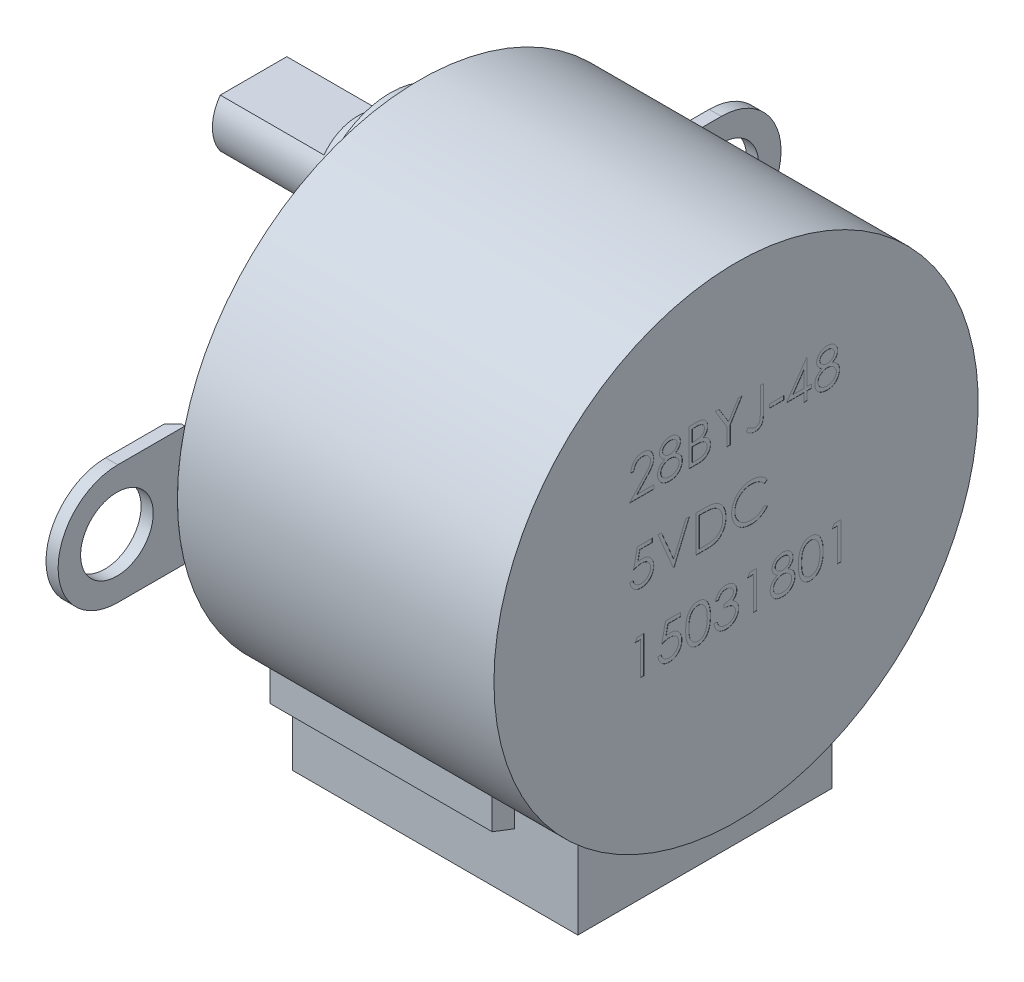
from build123d import *

# Parameters (mm, degrees)
SKETCH1_W                           = 18.3
SKETCH1_H                           = 14
SKETCH2_W                           = 14.7
SKETCH2_H                           = 4.984568829
BOSS_EXTRUDE1_DEPTH                 = 16.5
BOSS_EXTRUDE2_DEPTH                 = 3.7
BOSS_EXTRUDE2_DEPTH_BACK            = 9.15
BOSS_EXTRUDE4_DEPTH                 = 0.7
BOSS_EXTRUDE4_2_DEPTH               = 0.7
CHAMFER1_SIZE                       = 0.5
CHAMFER2_SIZE                       = 0.5
SKETCH9_W                           = 2.1
SKETCH9_H                           = 19
F_4_2_4_2_DIAMETER_HOLE2_AT_2_COUNT = 2
F_4_2_4_2_DIAMETER_HOLE2_AT_2_PITCH = 35
SKETCH10_R                          = 4.5
BOSS_EXTRUDE5_DEPTH                 = 1.7
SKETCH11_R                          = 2.38
BOSS_EXTRUDE6_DEPTH                 = 7.9
SKETCH12_W                          = 5.449122878
SKETCH12_H                          = 1.352337065
SKETCH12_H_2                        = 1.153463967
CUT_EXTRUDE1_DEPTH                  = 6
SKETCH13_W                          = 0.814102564
SKETCH13_H                          = 0.217094017
CUT_EXTRUDE2_DEPTH                  = 0.01
SKETCH14_W                          = 1.219270159
SKETCH14_H                          = 6
CUT_EXTRUDE3_DEPTH                  = 10.01


with BuildPart() as part:
    # Sketch1 → Revolve1 (revolve)
    with BuildSketch(Plane(origin=(0, 0, 0), x_dir=(1, 0, 0), z_dir=(0, 1, 0)), mode=Mode.PRIVATE) as revolve1_sk:
        with Locations((9.15, 7)):
            Rectangle(SKETCH1_W, SKETCH1_H)
    revolve(revolve1_sk.sketch.rotate(Axis((0, 0, 0), (1, 0, 0)), 180), axis=Axis((0, 0, 0), (1, 0, 0)))

    # Sketch2 → Boss-Extrude1 (add)
    with BuildSketch(Plane(origin=(0, 0, 0), x_dir=(0, 0, -1), z_dir=(1, 0, 0))):
        with Locations((0, -14.407715586)):
            Rectangle(SKETCH2_W, SKETCH2_H)
    extrude(amount=BOSS_EXTRUDE1_DEPTH)

    # Sketch3 → Boss-Extrude2 (add, two sides: drawn at the far end of the back side and taken through both)
    with BuildSketch(Plane(origin=(9.15, 0, 0), x_dir=(0, 0, -1), z_dir=(1, 0, 0)).offset(-BOSS_EXTRUDE2_DEPTH_BACK)):
        Polygon((-8.65, -12.9), (-8.65, -9.44187494), (8.65, -9.44187494), (8.65, -12.9), (7.35, -13.4), (-7.35, -13.4), align=None)
    extrude(amount=BOSS_EXTRUDE2_DEPTH + BOSS_EXTRUDE2_DEPTH_BACK)

    # Sketch10 → Boss-Extrude5 (add)
    with BuildSketch(Plane.ZY):
        with Locations(Location((0, 8, 0), (0, 0, 180))):
            Circle(SKETCH10_R)
    extrude(amount=BOSS_EXTRUDE5_DEPTH)

    # Sketch11 → Boss-Extrude6 (add)
    with BuildSketch(Plane.ZY.offset(1.7)):
        with Locations((0, 8)):
            Circle(SKETCH11_R)
    extrude(amount=BOSS_EXTRUDE6_DEPTH)

    # Sketch12 → Cut-Extrude1 (cut)
    with BuildSketch(Plane.ZY.offset(9.6)):
        with Locations((0.019544441, 10.076168533)):
            Rectangle(SKETCH12_W, SKETCH12_H)
        with Locations((0.019544441, 6.023268017)):
            Rectangle(SKETCH12_W, SKETCH12_H_2)
    extrude(amount=-CUT_EXTRUDE1_DEPTH, mode=Mode.SUBTRACT)

    # Sketch13 → Cut-Extrude2 (cut)
    # profile 1 of 20: a face of its own
    with BuildSketch(Plane(origin=(18.3, 0, 0), x_dir=(0, 0, -1), z_dir=(1, 0, 0))):
        with BuildLine():
            Line((-5.898627762, 6.499105901), (-6.088585026, 6.499105901))
            add(Edge.make_bspline(
                [(-6.088585026, 6.499105901), (-6.087346986, 6.524306867), (-6.084915508, 6.573800892), (-6.073528876, 6.645963445), (-6.05723606, 6.714939442), (-6.0341998, 6.780175057), (-6.005590765, 6.842247097), (-5.971282606, 6.900909012), (-5.930646325, 6.955937016), (-5.884559395, 7.006820983), (-5.834504075, 7.053501086), (-5.780495245, 7.093811637), (-5.723741348, 7.12787042), (-5.664414568, 7.156343361), (-5.601845561, 7.177715554), (-5.536602118, 7.193573402), (-5.468397593, 7.203114335), (-5.421927675, 7.204139882), (-5.398293894, 7.204661457)],
                knots=[0, 0, 0, 0, 1.10065271, 2.161652631, 3.183658789, 4.190468796, 5.17591951, 6.163126047, 7.15150782, 8.156236427, 9.156009102, 10.134482811, 11.092018607, 12.041330605, 13.001268258, 13.972401359, 14.968799086, 16, 16, 16, 16], degree=3))
            add(Edge.make_bspline(
                [(-5.398293894, 7.204661457), (-5.375084297, 7.204118104), (-5.329478267, 7.203050437), (-5.262916954, 7.193881624), (-5.199551638, 7.179521194), (-5.139506179, 7.1593733), (-5.083259654, 7.132289384), (-5.030389527, 7.099754682), (-4.98026637, 7.062126499), (-4.93514703, 7.017825383), (-4.893715953, 6.97053156), (-4.857973161, 6.920041256), (-4.827364248, 6.867893069), (-4.801850746, 6.813689347), (-4.783069176, 6.756919725), (-4.768809974, 6.698410703), (-4.760750062, 6.63755665), (-4.759513068, 6.5963684), (-4.758884172, 6.575428016)],
                knots=[0, 0, 0, 0, 1.111607364, 2.184268762, 3.212621178, 4.221274766, 5.211760367, 6.196651075, 7.1921475, 8.207485113, 9.220403448, 10.201281604, 11.166441695, 12.114753415, 13.065576456, 14.026450734, 14.996634279, 16, 16, 16, 16], degree=3))
            add(Edge.make_bspline(
                [(-4.758884172, 6.575428016), (-4.759908193, 6.545947183), (-4.761938264, 6.487502863), (-4.779303625, 6.401617685), (-4.806425087, 6.318406426), (-4.839080631, 6.251436725), (-4.87202349, 6.197471707), (-4.901709745, 6.153040633), (-4.936462273, 6.105200659), (-4.976786889, 6.054111984), (-5.021849435, 5.999374436), (-5.072058077, 5.941021084), (-5.127770849, 5.879654823), (-5.166873847, 5.837741436), (-5.187136041, 5.816022968)],
                knots=[0, 0, 0, 0, 1.184426356, 2.348067706, 3.509069118, 4.696110526, 5.333549288, 6.050745305, 6.844228056, 7.710549037, 8.667450064, 9.695053472, 10.805634456, 12, 12, 12, 12], degree=3))
            Line((-5.187136041, 5.816022968), (-5.71672672, 5.250815303))
            Line((-5.71672672, 5.250815303), (-4.73174742, 5.250815303))
            Line((-4.73174742, 5.250815303), (-4.73174742, 5.033721286))
            Line((-4.73174742, 5.033721286), (-6.169995283, 5.033721286))
            Line((-6.169995283, 5.033721286), (-5.349108531, 5.909729566))
            add(Edge.make_bspline(
                [(-5.349108531, 5.909729566), (-5.329122428, 5.930592827), (-5.290733214, 5.970666883), (-5.236436132, 6.02917334), (-5.187668744, 6.083450443), (-5.144115368, 6.133395641), (-5.10672082, 6.179739494), (-5.073536184, 6.220981053), (-5.04694747, 6.258932554), (-5.018091016, 6.302923306), (-4.990142561, 6.356633612), (-4.966126041, 6.422270653), (-4.951481823, 6.489839039), (-4.949725089, 6.535499795), (-4.948841437, 6.558467546)],
                knots=[0, 0, 0, 0, 1.329631726, 2.553950428, 3.673215718, 4.687767853, 5.603093632, 6.413772471, 7.123043292, 7.734684054, 8.834405432, 9.900288307, 10.943827018, 12, 12, 12, 12], degree=3))
            add(Edge.make_bspline(
                [(-4.948841437, 6.558467546), (-4.949225909, 6.572910106), (-4.949983631, 6.601373619), (-4.956670906, 6.643105673), (-4.966776783, 6.683361537), (-4.981257963, 6.722265035), (-5.000372515, 6.759425024), (-5.02363975, 6.794886739), (-5.050485169, 6.829170065), (-5.081540461, 6.861315155), (-5.115655999, 6.890755694), (-5.151696331, 6.916835498), (-5.189826632, 6.938630579), (-5.229886134, 6.95649736), (-5.271763156, 6.970512948), (-5.315538693, 6.980224565), (-5.361091788, 6.986322067), (-5.392196807, 6.987147067), (-5.408046164, 6.98756744)],
                knots=[0, 0, 0, 0, 0.991446411, 1.95395049, 2.89581595, 3.838931463, 4.798493298, 5.75982156, 6.748411868, 7.785213223, 8.824556874, 9.840280684, 10.836137867, 11.835679398, 12.848801643, 13.863922112, 14.911575587, 16, 16, 16, 16], degree=3))
            add(Edge.make_bspline(
                [(-5.408046164, 6.98756744), (-5.424599001, 6.987135015), (-5.45710604, 6.986285805), (-5.504833265, 6.980345432), (-5.550363235, 6.970097234), (-5.593810481, 6.956080864), (-5.635248516, 6.938265456), (-5.674475819, 6.916075686), (-5.711404328, 6.889597098), (-5.746103464, 6.85957638), (-5.778073584, 6.826152641), (-5.806162885, 6.788893282), (-5.830706551, 6.748478607), (-5.852120707, 6.705017664), (-5.869511053, 6.658116093), (-5.882799577, 6.607940385), (-5.893314479, 6.554708407), (-5.896827251, 6.517947903), (-5.898627762, 6.499105901)],
                knots=[0, 0, 0, 0, 1.031018746, 2.02475058, 2.990194455, 3.934040569, 4.864654155, 5.795059489, 6.735614925, 7.690564532, 8.649604399, 9.611025574, 10.590972636, 11.591080095, 12.624614302, 13.701020113, 14.821632451, 16, 16, 16, 16], degree=3))
        make_face()
    # profile 2 of 20: a face of its own
    with BuildSketch(Plane(origin=(18.3, 0, 0), x_dir=(0, 0, -1), z_dir=(1, 0, 0))):
        with BuildLine():
            add(Edge.make_bspline(
                [(-3.512713632, 6.212897968), (-3.495388082, 6.203864062), (-3.461597474, 6.186244927), (-3.41347221, 6.157875045), (-3.369490899, 6.127975033), (-3.328433274, 6.097957156), (-3.291020676, 6.066671824), (-3.257671436, 6.03399463), (-3.22756178, 6.000741225), (-3.201298915, 5.966348512), (-3.178198924, 5.930907862), (-3.158234442, 5.894326254), (-3.141169753, 5.856683857), (-3.127645499, 5.817569774), (-3.116504701, 5.777558568), (-3.108838978, 5.736133598), (-3.104716366, 5.69356783), (-3.103936941, 5.664800333), (-3.103542291, 5.650234373)],
                knots=[0, 0, 0, 0, 1.272397273, 2.481599622, 3.635517121, 4.734568067, 5.792894095, 6.808321871, 7.773003508, 8.711915296, 9.623354172, 10.525449501, 11.423591555, 12.311487226, 13.218079475, 14.126165749, 15.051214107, 16, 16, 16, 16], degree=3))
            add(Edge.make_bspline(
                [(-3.103542291, 5.650234373), (-3.104008817, 5.629855268), (-3.104932247, 5.589517373), (-3.11297557, 5.529980915), (-3.125018181, 5.472158552), (-3.142604362, 5.41606296), (-3.165411984, 5.362003672), (-3.193519404, 5.309934414), (-3.225336657, 5.259001784), (-3.250889202, 5.227663384), (-3.263818734, 5.211806222)],
                knots=[0, 0, 0, 0, 1.025265484, 2.029385089, 3.018602448, 3.995076438, 4.983346944, 5.966715145, 6.97116228, 8, 8, 8, 8], degree=3))
            add(Edge.make_bspline(
                [(-3.263818734, 5.211806222), (-3.280653173, 5.193304272), (-3.314114024, 5.156529008), (-3.371435127, 5.108782566), (-3.4343436, 5.06865698), (-3.50259602, 5.035956358), (-3.576009943, 5.010504433), (-3.654569727, 4.992214911), (-3.738428524, 4.981738965), (-3.796065643, 4.980224648), (-3.825634305, 4.979447781)],
                knots=[0, 0, 0, 0, 0.954267603, 1.896743057, 2.838368354, 3.796610408, 4.779680527, 5.799409237, 6.871065594, 8, 8, 8, 8], degree=3))
            add(Edge.make_bspline(
                [(-3.825634305, 4.979447781), (-3.854066212, 4.980144756), (-3.909391814, 4.981500998), (-3.989920625, 4.990690012), (-4.06498553, 5.006793531), (-4.135022987, 5.028833842), (-4.199610768, 5.057505742), (-4.258564834, 5.09319178), (-4.31273576, 5.134455557), (-4.36047958, 5.182482166), (-4.4028664, 5.233921927), (-4.440100413, 5.286990758), (-4.471048547, 5.341693502), (-4.497251123, 5.397214496), (-4.51730988, 5.454331932), (-4.531202598, 5.51275194), (-4.540025659, 5.572372479), (-4.541199583, 5.612608288), (-4.541790155, 5.632849891)],
                knots=[0, 0, 0, 0, 1.256902934, 2.445805442, 3.576955095, 4.645999104, 5.686449165, 6.692658513, 7.68621702, 8.689161843, 9.678783111, 10.630372946, 11.551080876, 12.453998257, 13.34127905, 14.221779781, 15.105423033, 16, 16, 16, 16], degree=3))
            add(Edge.make_bspline(
                [(-4.541790155, 5.632849891), (-4.541440674, 5.647702355), (-4.540749978, 5.677056066), (-4.535969426, 5.720423136), (-4.528283833, 5.762633179), (-4.517845971, 5.803842105), (-4.50369997, 5.843749903), (-4.486620203, 5.882545666), (-4.466704213, 5.920273193), (-4.443674175, 5.957138802), (-4.416881999, 5.992625935), (-4.386544934, 6.027336846), (-4.352056652, 6.060732928), (-4.313800829, 6.093222204), (-4.272214656, 6.125381007), (-4.226217959, 6.155471376), (-4.177030092, 6.185623574), (-4.142071585, 6.203650514), (-4.124138579, 6.212897968)],
                knots=[0, 0, 0, 0, 0.941657376, 1.861047343, 2.762797495, 3.66048619, 4.553285746, 5.444104102, 6.34607688, 7.256116206, 8.197091036, 9.162375105, 10.176350973, 11.237807142, 12.343728897, 13.50695164, 14.721116704, 16, 16, 16, 16], degree=3))
            add(Edge.make_bspline(
                [(-4.124138579, 6.212897968), (-4.148686696, 6.226284233), (-4.196218722, 6.252203789), (-4.259155955, 6.299826857), (-4.313215999, 6.351405679), (-4.356912899, 6.408029412), (-4.391307056, 6.467929188), (-4.414904022, 6.530730236), (-4.43086761, 6.595268076), (-4.432448958, 6.639358966), (-4.433243146, 6.661502402)],
                knots=[0, 0, 0, 0, 1.166880483, 2.259407225, 3.286803203, 4.280235371, 5.237608625, 6.161067461, 7.076446754, 8, 8, 8, 8], degree=3))
            add(Edge.make_bspline(
                [(-4.433243146, 6.661502402), (-4.432254104, 6.684058545), (-4.430265957, 6.729400325), (-4.414189377, 6.796895456), (-4.387991051, 6.863187379), (-4.352357877, 6.927954786), (-4.307976084, 6.98900563), (-4.254728887, 7.043761346), (-4.193887846, 7.091725909), (-4.12575666, 7.131988642), (-4.052437603, 7.164756854), (-3.975079046, 7.187361901), (-3.895028833, 7.202139933), (-3.840541165, 7.2038131), (-3.812913953, 7.204661457)],
                knots=[0, 0, 0, 0, 0.888701115, 1.786444228, 2.72001202, 3.692817113, 4.693886446, 5.687152267, 6.695133018, 7.739871481, 8.800368666, 9.853104506, 10.91144658, 12, 12, 12, 12], degree=3))
            add(Edge.make_bspline(
                [(-3.812913953, 7.204661457), (-3.785999741, 7.203786763), (-3.732927981, 7.202061968), (-3.654916944, 7.18767657), (-3.58027428, 7.16364967), (-3.509257393, 7.131054683), (-3.443137645, 7.09090639), (-3.384716248, 7.042283004), (-3.333110353, 6.987768828), (-3.2904236, 6.926736497), (-3.255248901, 6.862217961), (-3.230755499, 6.794712912), (-3.215060733, 6.72567991), (-3.213081127, 6.678969308), (-3.2120893, 6.655566238)],
                knots=[0, 0, 0, 0, 1.072916533, 2.115669174, 3.151510826, 4.193348718, 5.225979165, 6.227137561, 7.216255879, 8.211077061, 9.189680878, 10.138522389, 11.067357538, 12, 12, 12, 12], degree=3))
            add(Edge.make_bspline(
                [(-3.2120893, 6.655566238), (-3.212956868, 6.632599398), (-3.214660721, 6.58749383), (-3.228993542, 6.521740173), (-3.253131593, 6.460162083), (-3.286087587, 6.402060821), (-3.329041096, 6.348490106), (-3.381418758, 6.298768717), (-3.442802986, 6.252488206), (-3.488922665, 6.226370739), (-3.512713632, 6.212897968)],
                knots=[0, 0, 0, 0, 0.975232327, 1.915300861, 2.843280834, 3.77672583, 4.742871857, 5.749627742, 6.839139064, 8, 8, 8, 8], degree=3))
        make_face()
        with BuildLine():
            add(Edge.make_bspline(
                [(-3.823514247, 6.98756744), (-3.838361639, 6.987173473), (-3.86740963, 6.986402702), (-3.910002207, 6.982375812), (-3.950504543, 6.9745422), (-3.989339813, 6.964116884), (-4.025975571, 6.950033196), (-4.060909373, 6.933465738), (-4.093546674, 6.913323499), (-4.124281462, 6.89072887), (-4.151949787, 6.865877445), (-4.176505873, 6.839985339), (-4.196903352, 6.812544031), (-4.214224404, 6.784236118), (-4.226792274, 6.754221436), (-4.236204972, 6.723420201), (-4.242567909, 6.691443183), (-4.243044697, 6.669589198), (-4.243285881, 6.65853432)],
                knots=[0, 0, 0, 0, 1.203892937, 2.355340988, 3.463153438, 4.544400666, 5.610487187, 6.640501085, 7.674077295, 8.714426146, 9.728707835, 10.68524104, 11.601827946, 12.495867327, 13.368432065, 14.231010473, 15.105153427, 16, 16, 16, 16], degree=3))
            add(Edge.make_bspline(
                [(-4.243285881, 6.65853432), (-4.242870188, 6.647478964), (-4.242048718, 6.625631993), (-4.235695617, 6.593370445), (-4.226226948, 6.561667837), (-4.211319167, 6.531278), (-4.193438559, 6.50114673), (-4.171369905, 6.47202709), (-4.145069397, 6.443817738), (-4.115419469, 6.41675861), (-4.083118206, 6.391419834), (-4.048898332, 6.369422719), (-4.013189324, 6.351017329), (-3.976358073, 6.33569907), (-3.938029202, 6.323791346), (-3.898437573, 6.31534364), (-3.857576531, 6.310093099), (-3.82989018, 6.309465948), (-3.815882035, 6.309148636)],
                knots=[0, 0, 0, 0, 0.873023192, 1.725219244, 2.590779336, 3.480155217, 4.391973325, 5.357036234, 6.360879153, 7.436073238, 8.526419356, 9.601555421, 10.645666583, 11.697338044, 12.750135903, 13.812665442, 14.89329948, 16, 16, 16, 16], degree=3))
            add(Edge.make_bspline(
                [(-3.815882035, 6.309148636), (-3.797890306, 6.309676513), (-3.76208455, 6.310727053), (-3.709301335, 6.320494667), (-3.657979641, 6.335859198), (-3.608668017, 6.356880702), (-3.562642864, 6.38326517), (-3.521615775, 6.414853709), (-3.485936701, 6.45091693), (-3.455976428, 6.490893407), (-3.432747616, 6.533439367), (-3.414664141, 6.576135735), (-3.404104264, 6.619438036), (-3.402726878, 6.648446629), (-3.402046565, 6.662774437)],
                knots=[0, 0, 0, 0, 1.076279235, 2.141928126, 3.20205304, 4.278698113, 5.344010996, 6.36967002, 7.368914609, 8.37248503, 9.349703398, 10.264243087, 11.142681841, 12, 12, 12, 12], degree=3))
            add(Edge.make_bspline(
                [(-3.402046565, 6.662774437), (-3.402368236, 6.67283044), (-3.403006708, 6.692790164), (-3.40826817, 6.722265271), (-3.416962126, 6.751069828), (-3.428732656, 6.779441792), (-3.444220484, 6.806983092), (-3.462583588, 6.834126674), (-3.484889929, 6.860261921), (-3.509924915, 6.885997896), (-3.53831571, 6.909815853), (-3.5700076, 6.930761606), (-3.604838106, 6.948549079), (-3.642808052, 6.962996088), (-3.683777601, 6.973846938), (-3.727558054, 6.981972729), (-3.774514458, 6.986552658), (-3.806826736, 6.987221843), (-3.823514247, 6.98756744)],
                knots=[0, 0, 0, 0, 0.814439003, 1.616544685, 2.417341072, 3.248991801, 4.09997495, 4.973547432, 5.9003056, 6.880240646, 7.880314356, 8.896779544, 9.951930927, 11.043077905, 12.18215768, 13.381699519, 14.647792085, 16, 16, 16, 16], degree=3))
        make_face(mode=Mode.SUBTRACT)
        with BuildLine():
            add(Edge.make_bspline(
                [(-3.811217906, 6.092054619), (-3.830041595, 6.091719798), (-3.866969081, 6.09106296), (-3.921069223, 6.083751691), (-3.972989947, 6.073573915), (-4.022556194, 6.058133837), (-4.069747033, 6.038057864), (-4.114817932, 6.013906976), (-4.157424091, 5.985358922), (-4.196977169, 5.952776397), (-4.233095563, 5.917664251), (-4.264784059, 5.880494293), (-4.291694464, 5.841957333), (-4.313365049, 5.801563937), (-4.331152144, 5.76016943), (-4.342832441, 5.716742932), (-4.350320429, 5.672119296), (-4.351325925, 5.64178438), (-4.35183289, 5.626489715)],
                knots=[0, 0, 0, 0, 1.140299081, 2.23698856, 3.303958914, 4.344563908, 5.37730929, 6.408454204, 7.439741482, 8.480804886, 9.510774543, 10.48932336, 11.43758569, 12.353841022, 13.263987381, 14.161954604, 15.073269652, 16, 16, 16, 16], degree=3))
            add(Edge.make_bspline(
                [(-4.35183289, 5.626489715), (-4.351008443, 5.6074815), (-4.349372759, 5.569769647), (-4.336396601, 5.514032932), (-4.315571301, 5.460075437), (-4.28652748, 5.408336875), (-4.250563758, 5.359986097), (-4.206339656, 5.31784098), (-4.15660353, 5.280393229), (-4.099672542, 5.25010643), (-4.037485803, 5.225919065), (-3.970059853, 5.209254269), (-3.898362354, 5.198222535), (-3.848856791, 5.197110873), (-3.823514247, 5.196541798)],
                knots=[0, 0, 0, 0, 0.898778495, 1.783155532, 2.693654817, 3.627872908, 4.583023416, 5.533784346, 6.509005473, 7.520592997, 8.575161974, 9.658835044, 10.801527049, 12, 12, 12, 12], degree=3))
            add(Edge.make_bspline(
                [(-3.823514247, 5.196541798), (-3.803708072, 5.196922078), (-3.765119292, 5.197662984), (-3.708824456, 5.204203057), (-3.655699419, 5.214574497), (-3.605847203, 5.229659403), (-3.558709738, 5.248074389), (-3.515086234, 5.271764172), (-3.473854458, 5.298707719), (-3.437046155, 5.330674319), (-3.403522262, 5.364830966), (-3.374292128, 5.400989706), (-3.348917799, 5.438167827), (-3.329002412, 5.477205501), (-3.313081296, 5.517353778), (-3.301637051, 5.558982872), (-3.294575721, 5.602220466), (-3.29386156, 5.631550856), (-3.293499556, 5.646418268)],
                knots=[0, 0, 0, 0, 1.224942928, 2.386581632, 3.501229538, 4.569074225, 5.605009692, 6.626002462, 7.634866581, 8.645888296, 9.63523824, 10.59253846, 11.518950513, 12.414518923, 13.29783783, 14.186679152, 15.080837789, 16, 16, 16, 16], degree=3))
            add(Edge.make_bspline(
                [(-3.293499556, 5.646418268), (-3.294047379, 5.660858373), (-3.29512759, 5.68933174), (-3.301983589, 5.731523878), (-3.314027953, 5.772286532), (-3.330554521, 5.812110107), (-3.352556341, 5.850187701), (-3.378467287, 5.88751129), (-3.40972992, 5.92304495), (-3.445055633, 5.957064679), (-3.483554148, 5.988521815), (-3.524476659, 6.016349595), (-3.567508167, 6.039785398), (-3.612557614, 6.058845374), (-3.659524969, 6.073835891), (-3.708375687, 6.084307946), (-3.759166963, 6.09089961), (-3.793671576, 6.091665266), (-3.811217906, 6.092054619)],
                knots=[0, 0, 0, 0, 0.917430815, 1.809013306, 2.70690318, 3.612392954, 4.541220862, 5.495268465, 6.494511384, 7.542276156, 8.608045339, 9.649016899, 10.681629292, 11.715607085, 12.752076957, 13.808767841, 14.885711793, 16, 16, 16, 16], degree=3))
        make_face(mode=Mode.SUBTRACT)
    # profile 3 of 20: a face of its own
    with BuildSketch(Plane(origin=(18.3, 0, 0), x_dir=(0, 0, -1), z_dir=(1, 0, 0))):
        with BuildLine():
            Line((-2.723627762, 7.150387952), (-2.310640315, 7.150387952))
            add(Edge.make_bspline(
                [(-2.310640315, 7.150387952), (-2.290424045, 7.150281665), (-2.251239882, 7.150075654), (-2.194259553, 7.146880618), (-2.140890034, 7.142524113), (-2.091115848, 7.135611628), (-2.044959994, 7.127270887), (-2.002283376, 7.117170265), (-1.9632217, 7.105058932), (-1.916586855, 7.085799514), (-1.863415788, 7.057180264), (-1.805843427, 7.014890132), (-1.756613244, 6.963163357), (-1.714167233, 6.904814322), (-1.680420842, 6.840627451), (-1.656007029, 6.772132608), (-1.640550599, 6.700213269), (-1.638961023, 6.650838585), (-1.638157676, 6.625885415)],
                knots=[0, 0, 0, 0, 1.001505555, 1.941167018, 2.826882275, 3.653841531, 4.429895133, 5.150066043, 5.825578002, 6.45369114, 7.647487171, 8.808567382, 9.977351308, 11.170798116, 12.373658725, 13.556498008, 14.765093433, 16, 16, 16, 16], degree=3))
            add(Edge.make_bspline(
                [(-1.638157676, 6.625885415), (-1.638818813, 6.602509822), (-1.640118009, 6.556574577), (-1.652541487, 6.489389092), (-1.671991035, 6.425434783), (-1.699027066, 6.364945055), (-1.73416494, 6.309286632), (-1.775807828, 6.258010523), (-1.826049513, 6.213287741), (-1.863691854, 6.188285128), (-1.882812457, 6.175584934)],
                knots=[0, 0, 0, 0, 1.044552857, 2.05264487, 3.044412934, 4.028983338, 5.005914585, 5.980388656, 6.974128949, 8, 8, 8, 8], degree=3))
            add(Edge.make_bspline(
                [(-1.882812457, 6.175584934), (-1.858766865, 6.166353244), (-1.812761691, 6.148690735), (-1.749451579, 6.117463573), (-1.694905173, 6.083498868), (-1.648703089, 6.046407702), (-1.609189364, 6.006427612), (-1.574685919, 5.962972376), (-1.545245278, 5.915475127), (-1.520018891, 5.864431084), (-1.500334644, 5.810361458), (-1.485593025, 5.753773417), (-1.477146044, 5.694869877), (-1.475943994, 5.654783005), (-1.475337163, 5.634545938)],
                knots=[0, 0, 0, 0, 1.27268992, 2.434971085, 3.483601985, 4.442670788, 5.356604649, 6.2567628, 7.179492994, 8.113709626, 9.066344395, 10.018646069, 10.999752585, 12, 12, 12, 12], degree=3))
            add(Edge.make_bspline(
                [(-1.475337163, 5.634545938), (-1.475927922, 5.613883116), (-1.477090258, 5.573228433), (-1.485665765, 5.51350509), (-1.500185558, 5.456430718), (-1.520185727, 5.401636155), (-1.546288651, 5.349227407), (-1.578055563, 5.299145099), (-1.615932746, 5.251892433), (-1.658304101, 5.206944337), (-1.706238827, 5.166529437), (-1.757955497, 5.130536605), (-1.814105415, 5.100935891), (-1.873766383, 5.076070488), (-1.937607659, 5.05707661), (-2.00534257, 5.043788435), (-2.076912695, 5.034834912), (-2.126025259, 5.034098793), (-2.151211896, 5.033721286)],
                knots=[0, 0, 0, 0, 0.978564426, 1.925352924, 2.850884081, 3.763762016, 4.682927383, 5.618979971, 6.567305752, 7.547517671, 8.540179244, 9.531824382, 10.526200242, 11.540722885, 12.589160233, 13.674978461, 14.80764778, 16, 16, 16, 16], degree=3))
            Line((-2.151211896, 5.033721286), (-2.723627762, 5.033721286))
            Line((-2.723627762, 5.033721286), (-2.723627762, 7.150387952))
        make_face()
        with BuildLine():
            Line((-2.533670497, 6.933293935), (-2.533670497, 6.254875132))
            Line((-2.533670497, 6.254875132), (-2.406042959, 6.254875132))
            add(Edge.make_bspline(
                [(-2.406042959, 6.254875132), (-2.387386783, 6.25511699), (-2.351339249, 6.255584309), (-2.299136263, 6.25692296), (-2.250679705, 6.260671301), (-2.206053215, 6.264418564), (-2.165327071, 6.270511291), (-2.128591497, 6.27776367), (-2.095269965, 6.285433808), (-2.056843668, 6.298478212), (-2.013256695, 6.317756615), (-1.96679096, 6.347675297), (-1.925827733, 6.383310501), (-1.891237053, 6.424428845), (-1.862927259, 6.469705062), (-1.843264203, 6.518416747), (-1.829930845, 6.569349874), (-1.828726443, 6.604316151), (-1.828114941, 6.622069309)],
                knots=[0, 0, 0, 0, 1.156816544, 2.235205308, 3.236616184, 4.169592532, 5.011045266, 5.787822928, 6.49130361, 7.128639758, 8.301311294, 9.436451833, 10.541879658, 11.654887649, 12.756523258, 13.837046038, 14.901820046, 16, 16, 16, 16], degree=3))
            add(Edge.make_bspline(
                [(-1.828114941, 6.622069309), (-1.828433155, 6.633817276), (-1.829057366, 6.656862195), (-1.834169601, 6.690456328), (-1.842858563, 6.72205136), (-1.854019016, 6.752080274), (-1.869615033, 6.779604107), (-1.887977699, 6.805574516), (-1.910163807, 6.829107083), (-1.935417039, 6.85110197), (-1.964450825, 6.870602232), (-1.997247844, 6.88768117), (-2.03425182, 6.901433925), (-2.074839118, 6.913478455), (-2.11963449, 6.921938043), (-2.168121006, 6.928985568), (-2.220695812, 6.932573464), (-2.257069279, 6.933048421), (-2.275871351, 6.933293935)],
                knots=[0, 0, 0, 0, 0.91205012, 1.789085906, 2.630437955, 3.453916878, 4.269457761, 5.079663411, 5.91843418, 6.774407191, 7.675494373, 8.627863946, 9.638891023, 10.736472738, 11.911756761, 13.175263542, 14.539845004, 16, 16, 16, 16], degree=3))
            Line((-2.275871351, 6.933293935), (-2.533670497, 6.933293935))
        make_face(mode=Mode.SUBTRACT)
        with BuildLine():
            Line((-2.533670497, 6.037781115), (-2.533670497, 5.250815303))
            Line((-2.533670497, 5.250815303), (-2.263150999, 5.250815303))
            add(Edge.make_bspline(
                [(-2.263150999, 5.250815303), (-2.243787172, 5.251047379), (-2.206465949, 5.251494674), (-2.152580919, 5.252954905), (-2.102637804, 5.256276424), (-2.056864503, 5.261505104), (-2.014766753, 5.267176833), (-1.976849571, 5.274803655), (-1.942805592, 5.283541836), (-1.903330177, 5.297048693), (-1.858878056, 5.318031797), (-1.810974347, 5.349669448), (-1.768383253, 5.38736021), (-1.732215311, 5.430982239), (-1.702574123, 5.478414518), (-1.681011062, 5.528697658), (-1.667711829, 5.58100081), (-1.666101851, 5.616661632), (-1.665294428, 5.634545938)],
                knots=[0, 0, 0, 0, 1.160039823, 2.235823828, 3.228722157, 4.157150951, 4.99529583, 5.772374946, 6.472645482, 7.099169577, 8.269452708, 9.405989375, 10.527446681, 11.663510218, 12.788923519, 13.866172445, 14.929861265, 16, 16, 16, 16], degree=3))
            add(Edge.make_bspline(
                [(-1.665294428, 5.634545938), (-1.665461406, 5.645730006), (-1.665792667, 5.667917742), (-1.670788372, 5.700523975), (-1.678053903, 5.732108194), (-1.687446722, 5.762756161), (-1.701126115, 5.791913774), (-1.717095787, 5.820157703), (-1.735820063, 5.847525284), (-1.764996297, 5.882125075), (-1.80743364, 5.921989173), (-1.867732499, 5.961018996), (-1.936295746, 5.992495527), (-1.986023801, 6.005860448), (-2.01171203, 6.012764421)],
                knots=[0, 0, 0, 0, 0.723448775, 1.435228256, 2.130040452, 2.821711965, 3.505591119, 4.210454504, 4.921174351, 5.648778258, 7.137944449, 8.670945889, 10.280296675, 12, 12, 12, 12], degree=3))
            add(Edge.make_bspline(
                [(-2.01171203, 6.012764421), (-2.022010578, 6.014853925), (-2.044339955, 6.019384398), (-2.080751206, 6.024166676), (-2.122320041, 6.02842726), (-2.169142448, 6.03157877), (-2.221277666, 6.034836346), (-2.278837041, 6.036103214), (-2.341585512, 6.037614671), (-2.385123756, 6.037724214), (-2.407739006, 6.037781115)],
                knots=[0, 0, 0, 0, 0.634451884, 1.375622551, 2.216452059, 3.157844607, 4.20941857, 5.370758133, 6.634282058, 8, 8, 8, 8], degree=3))
            Line((-2.407739006, 6.037781115), (-2.533670497, 6.037781115))
        make_face(mode=Mode.SUBTRACT)
    # profile 4 of 20: a face of its own
    with BuildSketch(Plane(origin=(18.3, 0, 0), x_dir=(0, 0, -1), z_dir=(1, 0, 0))):
        Polygon((-1.203969642, 7.150387952), (-0.986451613, 7.150387952), (-0.430148194, 6.240882744), (0.125307201, 7.150387952), (0.34282523, 7.150387952), (-0.335593573, 6.039901173), (-0.335593573, 5.033721286), (-0.525550838, 5.033721286), (-0.525550838, 6.039901173), align=None)
    # profile 5 of 20: a face of its own
    with BuildSketch(Plane(origin=(18.3, 0, 0), x_dir=(0, 0, -1), z_dir=(1, 0, 0))):
        with BuildLine():
            Line((1.401158563, 7.150387952), (1.591115828, 7.150387952))
            Line((1.591115828, 7.150387952), (1.591115828, 5.721044336))
            add(Edge.make_bspline(
                [(1.591115828, 5.721044336), (1.590925982, 5.694613113), (1.590561455, 5.643861941), (1.588557025, 5.570762014), (1.584847732, 5.504014027), (1.579444176, 5.443466205), (1.572235274, 5.389308231), (1.5639857, 5.341121638), (1.553999388, 5.299308592), (1.538961096, 5.252357686), (1.514302566, 5.200865957), (1.477190119, 5.145254985), (1.431087428, 5.096611922), (1.377686327, 5.054367655), (1.316520088, 5.020708282), (1.248848308, 4.996544912), (1.175087562, 4.981806347), (1.123925182, 4.980249747), (1.097566149, 4.979447781)],
                knots=[0, 0, 0, 0, 1.237770943, 2.376671248, 3.424123796, 4.367912054, 5.222547132, 5.982086412, 6.656319012, 7.234008312, 8.288027371, 9.317870876, 10.352700517, 11.413286737, 12.494591526, 13.606319346, 14.766767577, 16, 16, 16, 16], degree=3))
            add(Edge.make_bspline(
                [(1.097566149, 4.979447781), (1.077029427, 4.980101293), (1.035708184, 4.981416201), (0.974209517, 4.992133617), (0.912885465, 5.00865332), (0.851410541, 5.032845366), (0.78857019, 5.065747799), (0.723513323, 5.108797664), (0.655403108, 5.161914825), (0.610539883, 5.2024567), (0.587055999, 5.223678551)],
                knots=[0, 0, 0, 0, 0.848567217, 1.707373443, 2.573483905, 3.470863513, 4.432650262, 5.500696352, 6.691726801, 8, 8, 8, 8], degree=3))
            Line((0.587055999, 5.223678551), (0.698995102, 5.386499063))
            add(Edge.make_bspline(
                [(0.698995102, 5.386499063), (0.724820055, 5.3686904), (0.773580935, 5.335065321), (0.845247906, 5.291808758), (0.908746184, 5.254721634), (0.950283015, 5.235821447), (0.9695146, 5.227070645)],
                knots=[0, 0, 0, 0, 1.196737151, 2.259595785, 3.194191475, 4, 4, 4, 4], degree=3))
            add(Edge.make_bspline(
                [(0.9695146, 5.227070645), (0.981177017, 5.222498973), (1.004049613, 5.213532906), (1.039020019, 5.203526577), (1.073790827, 5.198058072), (1.096842956, 5.197041266), (1.108166443, 5.196541798)],
                knots=[0, 0, 0, 0, 1.051806502, 2.062826769, 3.048436908, 4, 4, 4, 4], degree=3))
            add(Edge.make_bspline(
                [(1.108166443, 5.196541798), (1.122791272, 5.19716031), (1.151699167, 5.198382878), (1.193708344, 5.20917744), (1.23389963, 5.225653817), (1.270832232, 5.249778552), (1.30487149, 5.278463268), (1.332958342, 5.313149997), (1.356373056, 5.351592283), (1.370463823, 5.387981686), (1.379441376, 5.421168981), (1.385139217, 5.45166902), (1.390121645, 5.487326676), (1.394464774, 5.528184512), (1.397007477, 5.574324327), (1.399860304, 5.625610642), (1.400891581, 5.68217276), (1.401066854, 5.72160986), (1.401158563, 5.742244923)],
                knots=[0, 0, 0, 0, 0.997221856, 1.971139923, 2.944579524, 3.951425367, 4.971190333, 5.972282193, 6.985401279, 8.033996657, 8.624075553, 9.332086008, 10.151144245, 11.082816738, 12.137127781, 13.306538797, 14.590673636, 16, 16, 16, 16], degree=3))
            Line((1.401158563, 5.742244923), (1.401158563, 7.150387952))
        make_face()
    # profile 6 of 20: a face of its own
    with BuildSketch(Plane(origin=(18.3, 0, 0), x_dir=(0, 0, -1), z_dir=(1, 0, 0))):
        with Locations((2.350944888, 5.84782385)):
            Rectangle(SKETCH13_W, SKETCH13_H)
    # profile 7 of 20: a face of its own
    with BuildSketch(Plane(origin=(18.3, 0, 0), x_dir=(0, 0, -1), z_dir=(1, 0, 0))):
        Polygon((4.076248708, 7.204661457), (4.114833777, 7.204661457), (4.114833777, 5.739276841), (4.359064546, 5.739276841), (4.359064546, 5.522182824), (4.114833777, 5.522182824), (4.114833777, 5.033721286), (3.924876512, 5.033721286), (3.924876512, 5.522182824), (2.920816683, 5.522182824), align=None)
        Polygon((3.924876512, 5.739276841), (3.924876512, 6.65853432), (3.293947025, 5.739276841), align=None, mode=Mode.SUBTRACT)
    # profile 8 of 20: a face of its own
    with BuildSketch(Plane(origin=(18.3, 0, 0), x_dir=(0, 0, -1), z_dir=(1, 0, 0))):
        with BuildLine():
            add(Edge.make_bspline(
                [(5.578098334, 6.212897968), (5.595423884, 6.203864062), (5.629214492, 6.186244927), (5.677339756, 6.157875045), (5.721321066, 6.127975033), (5.762378692, 6.097957156), (5.79979129, 6.066671824), (5.83314053, 6.03399463), (5.863250186, 6.000741225), (5.88951305, 5.966348512), (5.912613042, 5.930907862), (5.932577524, 5.894326254), (5.949642213, 5.856683857), (5.963166467, 5.817569774), (5.974307264, 5.777558568), (5.981972987, 5.736133598), (5.9860956, 5.69356783), (5.986875025, 5.664800333), (5.987269674, 5.650234373)],
                knots=[0, 0, 0, 0, 1.272397273, 2.481599622, 3.635517121, 4.734568067, 5.792894095, 6.808321871, 7.773003508, 8.711915296, 9.623354172, 10.525449501, 11.423591555, 12.311487226, 13.218079475, 14.126165749, 15.051214107, 16, 16, 16, 16], degree=3))
            add(Edge.make_bspline(
                [(5.987269674, 5.650234373), (5.986803149, 5.629855268), (5.985879719, 5.589517373), (5.977836395, 5.529980915), (5.965793785, 5.472158552), (5.948207603, 5.41606296), (5.925399981, 5.362003672), (5.897292561, 5.309934414), (5.865475309, 5.259001784), (5.839922764, 5.227663384), (5.826993232, 5.211806222)],
                knots=[0, 0, 0, 0, 1.025265484, 2.029385089, 3.018602448, 3.995076438, 4.983346944, 5.966715145, 6.97116228, 8, 8, 8, 8], degree=3))
            add(Edge.make_bspline(
                [(5.826993232, 5.211806222), (5.810158793, 5.193304272), (5.776697942, 5.156529008), (5.719376838, 5.108782566), (5.656468366, 5.06865698), (5.588215946, 5.035956358), (5.514802022, 5.010504433), (5.436242239, 4.992214911), (5.352383441, 4.981738965), (5.294746323, 4.980224648), (5.265177661, 4.979447781)],
                knots=[0, 0, 0, 0, 0.954267603, 1.896743057, 2.838368354, 3.796610408, 4.779680527, 5.799409237, 6.871065594, 8, 8, 8, 8], degree=3))
            add(Edge.make_bspline(
                [(5.265177661, 4.979447781), (5.236745754, 4.980144756), (5.181420152, 4.981500998), (5.10089134, 4.990690012), (5.025826436, 5.006793531), (4.955788979, 5.028833842), (4.891201198, 5.057505742), (4.832247132, 5.09319178), (4.778076206, 5.134455557), (4.730332386, 5.182482166), (4.687945565, 5.233921927), (4.650711552, 5.286990758), (4.619763419, 5.341693502), (4.593560842, 5.397214496), (4.573502086, 5.454331932), (4.559609368, 5.51275194), (4.550786307, 5.572372479), (4.549612382, 5.612608288), (4.549021811, 5.632849891)],
                knots=[0, 0, 0, 0, 1.256902934, 2.445805442, 3.576955095, 4.645999104, 5.686449165, 6.692658513, 7.68621702, 8.689161843, 9.678783111, 10.630372946, 11.551080876, 12.453998257, 13.34127905, 14.221779781, 15.105423033, 16, 16, 16, 16], degree=3))
            add(Edge.make_bspline(
                [(4.549021811, 5.632849891), (4.549371292, 5.647702355), (4.550061988, 5.677056066), (4.554842539, 5.720423136), (4.562528133, 5.762633179), (4.572965995, 5.803842105), (4.587111996, 5.843749903), (4.604191763, 5.882545666), (4.624107753, 5.920273193), (4.647137791, 5.957138802), (4.673929967, 5.992625935), (4.704267032, 6.027336846), (4.738755314, 6.060732928), (4.777011136, 6.093222204), (4.81859731, 6.125381007), (4.864594007, 6.155471376), (4.913781874, 6.185623574), (4.948740381, 6.203650514), (4.966673387, 6.212897968)],
                knots=[0, 0, 0, 0, 0.941657376, 1.861047343, 2.762797495, 3.66048619, 4.553285746, 5.444104102, 6.34607688, 7.256116206, 8.197091036, 9.162375105, 10.176350973, 11.237807142, 12.343728897, 13.50695164, 14.721116704, 16, 16, 16, 16], degree=3))
            add(Edge.make_bspline(
                [(4.966673387, 6.212897968), (4.94212527, 6.226284233), (4.894593244, 6.252203789), (4.831656011, 6.299826857), (4.777595967, 6.351405679), (4.733899066, 6.408029412), (4.69950491, 6.467929188), (4.675907944, 6.530730236), (4.659944356, 6.595268076), (4.658363008, 6.639358966), (4.65756882, 6.661502402)],
                knots=[0, 0, 0, 0, 1.166880483, 2.259407225, 3.286803203, 4.280235371, 5.237608625, 6.161067461, 7.076446754, 8, 8, 8, 8], degree=3))
            add(Edge.make_bspline(
                [(4.65756882, 6.661502402), (4.658557862, 6.684058545), (4.660546009, 6.729400325), (4.676622589, 6.796895456), (4.702820915, 6.863187379), (4.738454089, 6.927954786), (4.782835882, 6.98900563), (4.836083078, 7.043761346), (4.89692412, 7.091725909), (4.965055306, 7.131988642), (5.038374363, 7.164756854), (5.11573292, 7.187361901), (5.195783132, 7.202139933), (5.250270801, 7.2038131), (5.277898013, 7.204661457)],
                knots=[0, 0, 0, 0, 0.888701115, 1.786444228, 2.72001202, 3.692817113, 4.693886446, 5.687152267, 6.695133018, 7.739871481, 8.800368666, 9.853104506, 10.91144658, 12, 12, 12, 12], degree=3))
            add(Edge.make_bspline(
                [(5.277898013, 7.204661457), (5.304812225, 7.203786763), (5.357883985, 7.202061968), (5.435895021, 7.18767657), (5.510537685, 7.16364967), (5.581554573, 7.131054683), (5.647674321, 7.09090639), (5.706095718, 7.042283004), (5.757701613, 6.987768828), (5.800388365, 6.926736497), (5.835563065, 6.862217961), (5.860056467, 6.794712912), (5.875751232, 6.72567991), (5.877730838, 6.678969308), (5.878722666, 6.655566238)],
                knots=[0, 0, 0, 0, 1.072916533, 2.115669174, 3.151510826, 4.193348718, 5.225979165, 6.227137561, 7.216255879, 8.211077061, 9.189680878, 10.138522389, 11.067357538, 12, 12, 12, 12], degree=3))
            add(Edge.make_bspline(
                [(5.878722666, 6.655566238), (5.877855098, 6.632599398), (5.876151245, 6.58749383), (5.861818424, 6.521740173), (5.837680373, 6.460162083), (5.804724379, 6.402060821), (5.76177087, 6.348490106), (5.709393207, 6.298768717), (5.64800898, 6.252488206), (5.601889301, 6.226370739), (5.578098334, 6.212897968)],
                knots=[0, 0, 0, 0, 0.975232327, 1.915300861, 2.843280834, 3.77672583, 4.742871857, 5.749627742, 6.839139064, 8, 8, 8, 8], degree=3))
        make_face()
        with BuildLine():
            add(Edge.make_bspline(
                [(5.267297719, 6.98756744), (5.252450327, 6.987173473), (5.223402336, 6.986402702), (5.180809759, 6.982375812), (5.140307422, 6.9745422), (5.101472152, 6.964116884), (5.064836395, 6.950033196), (5.029902593, 6.933465738), (4.997265292, 6.913323499), (4.966530504, 6.89072887), (4.938862179, 6.865877445), (4.914306093, 6.839985339), (4.893908614, 6.812544031), (4.876587562, 6.784236118), (4.864019692, 6.754221436), (4.854606994, 6.723420201), (4.848244057, 6.691443183), (4.847767269, 6.669589198), (4.847526085, 6.65853432)],
                knots=[0, 0, 0, 0, 1.203892937, 2.355340988, 3.463153438, 4.544400666, 5.610487187, 6.640501085, 7.674077295, 8.714426146, 9.728707835, 10.68524104, 11.601827946, 12.495867327, 13.368432065, 14.231010473, 15.105153427, 16, 16, 16, 16], degree=3))
            add(Edge.make_bspline(
                [(4.847526085, 6.65853432), (4.847941778, 6.647478964), (4.848763248, 6.625631993), (4.855116349, 6.593370445), (4.864585018, 6.561667837), (4.879492799, 6.531278), (4.897373406, 6.50114673), (4.919442061, 6.47202709), (4.945742568, 6.443817738), (4.975392496, 6.41675861), (5.00769376, 6.391419834), (5.041913634, 6.369422719), (5.077622642, 6.351017329), (5.114453893, 6.33569907), (5.152782764, 6.323791346), (5.192374393, 6.31534364), (5.233235435, 6.310093099), (5.260921786, 6.309465948), (5.274929931, 6.309148636)],
                knots=[0, 0, 0, 0, 0.873023192, 1.725219244, 2.590779336, 3.480155217, 4.391973325, 5.357036234, 6.360879153, 7.436073238, 8.526419356, 9.601555421, 10.645666583, 11.697338044, 12.750135903, 13.812665442, 14.89329948, 16, 16, 16, 16], degree=3))
            add(Edge.make_bspline(
                [(5.274929931, 6.309148636), (5.29292166, 6.309676513), (5.328727416, 6.310727053), (5.381510631, 6.320494667), (5.432832325, 6.335859198), (5.482143948, 6.356880702), (5.528169102, 6.38326517), (5.569196191, 6.414853709), (5.604875264, 6.45091693), (5.634835538, 6.490893407), (5.65806435, 6.533439367), (5.676147824, 6.576135735), (5.686707702, 6.619438036), (5.688085088, 6.648446629), (5.688765401, 6.662774437)],
                knots=[0, 0, 0, 0, 1.076279235, 2.141928126, 3.20205304, 4.278698113, 5.344010996, 6.36967002, 7.368914609, 8.37248503, 9.349703398, 10.264243087, 11.142681841, 12, 12, 12, 12], degree=3))
            add(Edge.make_bspline(
                [(5.688765401, 6.662774437), (5.688443729, 6.67283044), (5.687805258, 6.692790164), (5.682543795, 6.722265271), (5.673849839, 6.751069828), (5.66207931, 6.779441792), (5.646591482, 6.806983092), (5.628228378, 6.834126674), (5.605922037, 6.860261921), (5.580887051, 6.885997896), (5.552496256, 6.909815853), (5.520804366, 6.930761606), (5.48597386, 6.948549079), (5.448003914, 6.962996088), (5.407034365, 6.973846938), (5.363253912, 6.981972729), (5.316297508, 6.986552658), (5.28398523, 6.987221843), (5.267297719, 6.98756744)],
                knots=[0, 0, 0, 0, 0.814439003, 1.616544685, 2.417341072, 3.248991801, 4.09997495, 4.973547432, 5.9003056, 6.880240646, 7.880314356, 8.896779544, 9.951930927, 11.043077905, 12.18215768, 13.381699519, 14.647792085, 16, 16, 16, 16], degree=3))
        make_face(mode=Mode.SUBTRACT)
        with BuildLine():
            add(Edge.make_bspline(
                [(5.27959406, 6.092054619), (5.260770371, 6.091719798), (5.223842885, 6.09106296), (5.169742743, 6.083751691), (5.117822019, 6.073573915), (5.068255772, 6.058133837), (5.021064932, 6.038057864), (4.975994034, 6.013906976), (4.933387874, 5.985358922), (4.893834797, 5.952776397), (4.857716403, 5.917664251), (4.826027907, 5.880494293), (4.799117502, 5.841957333), (4.777446917, 5.801563937), (4.759659822, 5.76016943), (4.747979524, 5.716742932), (4.740491537, 5.672119296), (4.739486041, 5.64178438), (4.738979076, 5.626489715)],
                knots=[0, 0, 0, 0, 1.140299081, 2.23698856, 3.303958914, 4.344563908, 5.37730929, 6.408454204, 7.439741482, 8.480804886, 9.510774543, 10.48932336, 11.43758569, 12.353841022, 13.263987381, 14.161954604, 15.073269652, 16, 16, 16, 16], degree=3))
            add(Edge.make_bspline(
                [(4.738979076, 5.626489715), (4.739803523, 5.6074815), (4.741439207, 5.569769647), (4.754415364, 5.514032932), (4.775240664, 5.460075437), (4.804284485, 5.408336875), (4.840248208, 5.359986097), (4.88447231, 5.31784098), (4.934208436, 5.280393229), (4.991139424, 5.25010643), (5.053326163, 5.225919065), (5.120752113, 5.209254269), (5.192449611, 5.198222535), (5.241955174, 5.197110873), (5.267297719, 5.196541798)],
                knots=[0, 0, 0, 0, 0.898778495, 1.783155532, 2.693654817, 3.627872908, 4.583023416, 5.533784346, 6.509005473, 7.520592997, 8.575161974, 9.658835044, 10.801527049, 12, 12, 12, 12], degree=3))
            add(Edge.make_bspline(
                [(5.267297719, 5.196541798), (5.287103894, 5.196922078), (5.325692674, 5.197662984), (5.38198751, 5.204203057), (5.435112547, 5.214574497), (5.484964763, 5.229659403), (5.532102228, 5.248074389), (5.575725732, 5.271764172), (5.616957508, 5.298707719), (5.653765811, 5.330674319), (5.687289704, 5.364830966), (5.716519838, 5.400989706), (5.741894167, 5.438167827), (5.761809554, 5.477205501), (5.777730669, 5.517353778), (5.789174914, 5.558982872), (5.796236245, 5.602220466), (5.796950405, 5.631550856), (5.797312409, 5.646418268)],
                knots=[0, 0, 0, 0, 1.224942928, 2.386581632, 3.501229538, 4.569074225, 5.605009692, 6.626002462, 7.634866581, 8.645888296, 9.63523824, 10.59253846, 11.518950513, 12.414518923, 13.29783783, 14.186679152, 15.080837789, 16, 16, 16, 16], degree=3))
            add(Edge.make_bspline(
                [(5.797312409, 5.646418268), (5.796764587, 5.660858373), (5.795684376, 5.68933174), (5.788828377, 5.731523878), (5.776784013, 5.772286532), (5.760257445, 5.812110107), (5.738255624, 5.850187701), (5.712344679, 5.88751129), (5.681082046, 5.92304495), (5.645756333, 5.957064679), (5.607257818, 5.988521815), (5.566335307, 6.016349595), (5.523303799, 6.039785398), (5.478254352, 6.058845374), (5.431286997, 6.073835891), (5.382436279, 6.084307946), (5.331645002, 6.09089961), (5.29714039, 6.091665266), (5.27959406, 6.092054619)],
                knots=[0, 0, 0, 0, 0.917430815, 1.809013306, 2.70690318, 3.612392954, 4.541220862, 5.495268465, 6.494511384, 7.542276156, 8.608045339, 9.649016899, 10.681629292, 11.715607085, 12.752076957, 13.808767841, 14.885711793, 16, 16, 16, 16], degree=3))
        make_face(mode=Mode.SUBTRACT)
    # profile 9 of 20: a face of its own
    with BuildSketch(Plane(origin=(18.3, 0, 0), x_dir=(0, 0, -1), z_dir=(1, 0, 0))):
        with BuildLine():
            Line((-4.840294428, 2.622610175), (-4.840294428, 2.405516157))
            Line((-4.840294428, 2.405516157), (-5.560266383, 2.405516157))
            Line((-5.560266383, 2.405516157), (-5.674325545, 1.848788727))
            add(Edge.make_bspline(
                [(-5.674325545, 1.848788727), (-5.651915563, 1.854975606), (-5.608499769, 1.866961704), (-5.544419282, 1.880269956), (-5.483584949, 1.888292391), (-5.444108892, 1.889387803), (-5.425006634, 1.889917867)],
                knots=[0, 0, 0, 0, 1.100273476, 2.13160584, 3.095893838, 4, 4, 4, 4], degree=3))
            add(Edge.make_bspline(
                [(-5.425006634, 1.889917867), (-5.401370277, 1.889406277), (-5.354895294, 1.888400364), (-5.286896503, 1.878741198), (-5.221985658, 1.863537535), (-5.16029851, 1.842297982), (-5.101720939, 1.815138286), (-5.04679189, 1.781211179), (-4.994686866, 1.741579117), (-4.946340631, 1.696013324), (-4.902480692, 1.645865489), (-4.863917451, 1.591946205), (-4.831161979, 1.534779476), (-4.804818094, 1.473819108), (-4.783781854, 1.409739049), (-4.76978041, 1.341865058), (-4.760456971, 1.270836909), (-4.759415338, 1.222271765), (-4.758884172, 1.197506676)],
                knots=[0, 0, 0, 0, 1.052922333, 2.070308379, 3.05430497, 4.020497103, 4.973039431, 5.925935799, 6.892292201, 7.88610001, 8.88166317, 9.857072816, 10.836096531, 11.812156883, 12.81219415, 13.836441305, 14.89672472, 16, 16, 16, 16], degree=3))
            add(Edge.make_bspline(
                [(-4.758884172, 1.197506676), (-4.759286384, 1.180257523), (-4.760085373, 1.145992326), (-4.764148519, 1.095105119), (-4.771971547, 1.045295215), (-4.782474885, 0.996556007), (-4.79610768, 0.948979767), (-4.812611061, 0.90243032), (-4.832807706, 0.857197391), (-4.854960966, 0.812852985), (-4.879905265, 0.770399602), (-4.907590362, 0.730697596), (-4.936839969, 0.693151388), (-4.968312616, 0.658163654), (-5.002300837, 0.625964305), (-5.038393007, 0.596362249), (-5.076301128, 0.568856873), (-5.116611679, 0.544564679), (-5.158426419, 0.522210891), (-5.202349198, 0.503872371), (-5.247380193, 0.487476956), (-5.294167522, 0.474408337), (-5.342605209, 0.464168173), (-5.392773097, 0.457213048), (-5.444408074, 0.452147298), (-5.479408677, 0.451830187), (-5.497088632, 0.451670004)],
                knots=[0, 0, 0, 0, 1.056347294, 2.098418968, 3.122841568, 4.141288669, 5.149314143, 6.15115421, 7.162517403, 8.180376062, 9.185164535, 10.17417709, 11.141909838, 12.097768115, 13.052685741, 14.0056014, 14.954263652, 15.917497458, 16.885230207, 17.854509472, 18.828990115, 19.81800267, 20.826176721, 21.857883937, 22.917946725, 24, 24, 24, 24], degree=3))
            add(Edge.make_bspline(
                [(-5.497088632, 0.451670004), (-5.518179208, 0.452087796), (-5.559672425, 0.452909753), (-5.620463434, 0.461508552), (-5.678952744, 0.473823873), (-5.734669519, 0.492351521), (-5.788113093, 0.515566695), (-5.838563975, 0.544907427), (-5.887311277, 0.578156695), (-5.932373318, 0.617393861), (-5.974196301, 0.660280964), (-6.011635, 0.706822013), (-6.044977686, 0.756248866), (-6.073690419, 0.808801559), (-6.09818208, 0.864342004), (-6.117422573, 0.923078295), (-6.132951863, 0.984703536), (-6.139521646, 1.027129706), (-6.142858531, 1.048678551)],
                knots=[0, 0, 0, 0, 1.0467383, 2.05933395, 3.04377827, 4.011590433, 4.970194871, 5.932262533, 6.905835911, 7.896367577, 8.894135286, 9.877477877, 10.858688626, 11.851381753, 12.8477658, 13.868841284, 14.917554742, 16, 16, 16, 16], degree=3))
            Line((-6.142858531, 1.048678551), (-5.952901266, 1.048678551))
            add(Edge.make_bspline(
                [(-5.952901266, 1.048678551), (-5.948227329, 1.028493744), (-5.939243762, 0.989697424), (-5.919525047, 0.935189422), (-5.895415685, 0.886615416), (-5.866747341, 0.843332858), (-5.832548036, 0.805590274), (-5.793523096, 0.771955194), (-5.749769949, 0.741611187), (-5.701151187, 0.716318371), (-5.649859467, 0.694747267), (-5.59617644, 0.680383147), (-5.541563812, 0.670283083), (-5.50462594, 0.669272066), (-5.486064327, 0.668764021)],
                knots=[0, 0, 0, 0, 1.136247022, 2.183929868, 3.172523383, 4.106158343, 5.02341133, 5.958108904, 6.928429099, 7.938127109, 8.96079061, 9.975095812, 10.982467395, 12, 12, 12, 12], degree=3))
            add(Edge.make_bspline(
                [(-5.486064327, 0.668764021), (-5.467946601, 0.669260396), (-5.43227265, 0.670237763), (-5.379772431, 0.677760403), (-5.329085597, 0.689346173), (-5.280712291, 0.706684609), (-5.233806027, 0.727757367), (-5.189553318, 0.754799342), (-5.146673959, 0.7859204), (-5.106500754, 0.821575124), (-5.069707373, 0.86086632), (-5.037197719, 0.902883601), (-5.010118347, 0.947706647), (-4.987298196, 0.994559458), (-4.969969772, 1.043955538), (-4.957607845, 1.095663391), (-4.950348853, 1.149810737), (-4.949350282, 1.186743129), (-4.948841437, 1.205562899)],
                knots=[0, 0, 0, 0, 1.027316725, 2.022795036, 3.002884548, 3.971462791, 4.93288096, 5.914575861, 6.907176829, 7.935150275, 8.956128384, 9.956726525, 10.942570165, 11.921478529, 12.907843606, 13.90538589, 14.932640048, 16, 16, 16, 16], degree=3))
            add(Edge.make_bspline(
                [(-4.948841437, 1.205562899), (-4.94923966, 1.222542044), (-4.950019125, 1.255776304), (-4.956387613, 1.304398682), (-4.96746502, 1.35040476), (-4.982840414, 1.394016701), (-5.002361831, 1.43527564), (-5.026217458, 1.474224157), (-5.054854989, 1.510348904), (-5.087567703, 1.543666782), (-5.123404708, 1.574415825), (-5.162982591, 1.600628678), (-5.205473118, 1.622680666), (-5.250364352, 1.641711312), (-5.298724076, 1.655379382), (-5.349594611, 1.665640913), (-5.403525287, 1.67157687), (-5.440398036, 1.672400489), (-5.459351586, 1.67282385)],
                knots=[0, 0, 0, 0, 1.045622112, 2.046656509, 3.013763289, 3.955457236, 4.890082067, 5.820317437, 6.762574623, 7.722996705, 8.69280354, 9.665887285, 10.63943826, 11.638615906, 12.663482002, 13.728887084, 14.832589034, 16, 16, 16, 16], degree=3))
            add(Edge.make_bspline(
                [(-5.459351586, 1.67282385), (-5.475758129, 1.67247273), (-5.509633477, 1.671747758), (-5.56159633, 1.666409829), (-5.616201324, 1.657798446), (-5.673239138, 1.64595343), (-5.732881064, 1.630452731), (-5.79500124, 1.611877771), (-5.859730277, 1.589669705), (-5.90334433, 1.572898319), (-5.925764514, 1.564276841)],
                knots=[0, 0, 0, 0, 0.817624296, 1.688186739, 2.600797293, 3.572016777, 4.590301741, 5.671205678, 6.80286297, 8, 8, 8, 8], degree=3))
            Line((-5.925764514, 1.564276841), (-5.708670497, 2.622610175))
            Line((-5.708670497, 2.622610175), (-4.840294428, 2.622610175))
        make_face()
    # profile 10 of 20: a face of its own
    with BuildSketch(Plane(origin=(18.3, 0, 0), x_dir=(0, 0, -1), z_dir=(1, 0, 0))):
        Polygon((-4.514653403, 2.622610175), (-4.311127762, 2.622610175), (-3.605572206, 0.954547942), (-2.90001665, 2.622610175), (-2.696491009, 2.622610175), (-3.59200383, 0.505943508), (-3.619140582, 0.505943508), align=None)
    # profile 11 of 20: a face of its own
    with BuildSketch(Plane(origin=(18.3, 0, 0), x_dir=(0, 0, -1), z_dir=(1, 0, 0))):
        with BuildLine():
            Line((-2.316576479, 0.505943508), (-2.316576479, 2.622610175))
            Line((-2.316576479, 2.622610175), (-1.889172633, 2.622610175))
            add(Edge.make_bspline(
                [(-1.889172633, 2.622610175), (-1.851998531, 2.622342525), (-1.780178359, 2.621825428), (-1.676393688, 2.618546777), (-1.580367317, 2.612746828), (-1.492415064, 2.604298591), (-1.412295474, 2.59392509), (-1.340232888, 2.580922464), (-1.275854687, 2.565568666), (-1.236261263, 2.552478322), (-1.217538018, 2.546288059)],
                knots=[0, 0, 0, 0, 1.314313732, 2.53924729, 3.670748893, 4.714932338, 5.66265055, 6.526160246, 7.303039223, 8, 8, 8, 8], degree=3))
            add(Edge.make_bspline(
                [(-1.217538018, 2.546288059), (-1.193048342, 2.536956156), (-1.144624335, 2.518503967), (-1.075677171, 2.483696109), (-1.01077088, 2.444257709), (-0.949557397, 2.400136782), (-0.893434993, 2.350084057), (-0.840211169, 2.296225725), (-0.792063217, 2.236603252), (-0.747971057, 2.17245314), (-0.708216635, 2.10453109), (-0.673661049, 2.032966524), (-0.644962681, 1.958122879), (-0.621139159, 1.88020829), (-0.602363444, 1.799051433), (-0.589553418, 1.714557809), (-0.581104296, 1.627061347), (-0.580255179, 1.567689171), (-0.579824343, 1.537564101)],
                knots=[0, 0, 0, 0, 0.984719456, 1.947108742, 2.898477687, 3.838006223, 4.779231079, 5.722358779, 6.681677486, 7.655904652, 8.64651281, 9.637519902, 10.640069247, 11.656948941, 12.698408672, 13.768548281, 14.867775369, 16, 16, 16, 16], degree=3))
            add(Edge.make_bspline(
                [(-0.579824343, 1.537564101), (-0.580204718, 1.511401352), (-0.580954288, 1.459844922), (-0.587684874, 1.383862095), (-0.597467696, 1.310133411), (-0.612613473, 1.239009964), (-0.630999755, 1.169868613), (-0.65456379, 1.103446256), (-0.681557637, 1.039133571), (-0.713035421, 0.977800146), (-0.747592354, 0.919692582), (-0.784677408, 0.864915953), (-0.824251029, 0.814251891), (-0.866690578, 0.767546968), (-0.911447626, 0.724871594), (-0.958815197, 0.68586928), (-1.008915518, 0.651303173), (-1.061524193, 0.61981497), (-1.118175948, 0.592346469), (-1.179943829, 0.569105463), (-1.247091255, 0.549845844), (-1.31945341, 0.533776778), (-1.397155323, 0.521030028), (-1.480273174, 0.512486924), (-1.568679258, 0.506709674), (-1.629384814, 0.506203856), (-1.660630299, 0.505943508)],
                knots=[0, 0, 0, 0, 1.105936401, 2.179363191, 3.223086493, 4.248585256, 5.251745608, 6.245858792, 7.225916811, 8.198733463, 9.158002045, 10.082870192, 10.993790845, 11.873723703, 12.748670949, 13.606408763, 14.465103618, 15.319838547, 16.196477973, 17.123216899, 18.106603292, 19.147568657, 20.255746949, 21.433717677, 22.679120308, 24, 24, 24, 24], degree=3))
            Line((-1.660630299, 0.505943508), (-2.316576479, 0.505943508))
        make_face()
        with BuildLine():
            Line((-2.126619214, 0.723037525), (-1.883660481, 0.723037525))
            add(Edge.make_bspline(
                [(-1.883660481, 0.723037525), (-1.848748561, 0.723187564), (-1.781600154, 0.723476145), (-1.68504508, 0.726008406), (-1.596822778, 0.730146149), (-1.516920723, 0.735936791), (-1.445384027, 0.743598287), (-1.382063188, 0.75214049), (-1.32716577, 0.762782758), (-1.293946539, 0.77242929), (-1.27859571, 0.776887018)],
                knots=[0, 0, 0, 0, 1.375205317, 2.645023457, 3.804390687, 4.853969522, 5.800190428, 6.637939096, 7.370582563, 8, 8, 8, 8], degree=3))
            add(Edge.make_bspline(
                [(-1.27859571, 0.776887018), (-1.259274558, 0.783691531), (-1.221093739, 0.797138033), (-1.16613232, 0.821665762), (-1.114874513, 0.850719775), (-1.066427021, 0.883015436), (-1.021477092, 0.919691828), (-0.979492031, 0.959951426), (-0.94055637, 1.003999123), (-0.905072384, 1.051780249), (-0.873317362, 1.102997412), (-0.845818094, 1.157147087), (-0.821717406, 1.213635968), (-0.802801305, 1.273331506), (-0.787975214, 1.335700032), (-0.777473712, 1.400745933), (-0.770933379, 1.46845706), (-0.770170503, 1.514510964), (-0.769781608, 1.537988113)],
                knots=[0, 0, 0, 0, 0.998632004, 1.973411704, 2.929992603, 3.868527914, 4.809262121, 5.754881198, 6.702106254, 7.672490631, 8.653608572, 9.636854334, 10.631411391, 11.644891563, 12.686317036, 13.754757253, 14.855430412, 16, 16, 16, 16], degree=3))
            add(Edge.make_bspline(
                [(-0.769781608, 1.537988113), (-0.770092024, 1.562743122), (-0.770701841, 1.611374557), (-0.778366781, 1.682730835), (-0.789567912, 1.751359609), (-0.805765665, 1.81726547), (-0.82640672, 1.880576998), (-0.852166337, 1.940944035), (-0.881598054, 1.999004122), (-0.916615786, 2.053417191), (-0.954967121, 2.104878262), (-0.997528982, 2.152022425), (-1.043625167, 2.194957073), (-1.092752909, 2.234350848), (-1.146296774, 2.268618881), (-1.202995435, 2.299272254), (-1.263680674, 2.325286627), (-1.305900733, 2.339122891), (-1.327357062, 2.346154512)],
                knots=[0, 0, 0, 0, 1.122418816, 2.205001699, 3.251619955, 4.274784885, 5.280384055, 6.268708349, 7.249350384, 8.229342522, 9.199999885, 10.157847722, 11.105861043, 12.055065948, 13.010012805, 13.98527497, 14.976112212, 16, 16, 16, 16], degree=3))
            add(Edge.make_bspline(
                [(-1.327357062, 2.346154512), (-1.345107517, 2.351063019), (-1.382849855, 2.36149985), (-1.444438483, 2.372884718), (-1.513753359, 2.382926486), (-1.591102226, 2.391428253), (-1.676396913, 2.397528681), (-1.76970302, 2.402107523), (-1.871060876, 2.40519582), (-1.941323646, 2.405406705), (-1.977791089, 2.405516157)],
                knots=[0, 0, 0, 0, 0.674548936, 1.434276114, 2.292660221, 3.240891867, 4.284742987, 5.42552168, 6.663806718, 8, 8, 8, 8], degree=3))
            Line((-1.977791089, 2.405516157), (-2.126619214, 2.405516157))
            Line((-2.126619214, 2.405516157), (-2.126619214, 0.723037525))
        make_face(mode=Mode.SUBTRACT)
    # profile 12 of 20: a face of its own
    with BuildSketch(Plane(origin=(18.3, 0, 0), x_dir=(0, 0, -1), z_dir=(1, 0, 0))):
        with BuildLine():
            Line((1.808209845, 2.23421541), (1.641997238, 2.107011884))
            add(Edge.make_bspline(
                [(1.641997238, 2.107011884), (1.630140344, 2.121142732), (1.606586412, 2.149213915), (1.568692513, 2.18863202), (1.529200567, 2.225561964), (1.48812567, 2.260179672), (1.444728488, 2.291274573), (1.400060291, 2.320467098), (1.353373854, 2.346633777), (1.288814472, 2.378361393), (1.204360773, 2.411469782), (1.098046751, 2.439230307), (0.98706623, 2.456902161), (0.911351491, 2.458816137), (0.87283992, 2.459789662)],
                knots=[0, 0, 0, 0, 0.757959112, 1.505699292, 2.245454638, 2.979532153, 3.711538275, 4.438200793, 5.171680507, 5.909471876, 7.393775596, 8.890124382, 10.418191784, 12, 12, 12, 12], degree=3))
            add(Edge.make_bspline(
                [(0.87283992, 2.459789662), (0.851622877, 2.459545361), (0.809385705, 2.459059026), (0.746703057, 2.452643031), (0.685190879, 2.443625299), (0.624889182, 2.430244747), (0.565874727, 2.413327972), (0.507761702, 2.393113555), (0.451391483, 2.368103723), (0.395984262, 2.340461109), (0.342898739, 2.309238797), (0.292670211, 2.275182627), (0.245481868, 2.238673698), (0.201296384, 2.199575171), (0.160068586, 2.158063129), (0.122097213, 2.11369517), (0.087513655, 2.066613141), (0.055632406, 2.01743789), (0.027079944, 1.966312654), (0.003173779, 1.913048206), (-0.017995986, 1.858556677), (-0.034747432, 1.802222404), (-0.048006545, 1.744441779), (-0.057155179, 1.685059731), (-0.063498207, 1.624200315), (-0.063982124, 1.582949921), (-0.064226052, 1.562156782)],
                knots=[0, 0, 0, 0, 1.054917814, 2.100044995, 3.131103042, 4.146048494, 5.169673617, 6.183595914, 7.203665975, 8.234915748, 9.262203917, 10.264457458, 11.251630812, 12.227803204, 13.197192746, 14.159520551, 15.12972552, 16.100847026, 17.073214652, 18.039054194, 19.002613845, 19.979014051, 20.95965708, 21.949030935, 22.966165397, 24, 24, 24, 24], degree=3))
            add(Edge.make_bspline(
                [(-0.064226052, 1.562156782), (-0.063462952, 1.530871651), (-0.061964706, 1.469447445), (-0.048630714, 1.379476647), (-0.028368111, 1.293285573), (0.002000357, 1.211413002), (0.03944664, 1.132849376), (0.086763581, 1.058923974), (0.141565011, 0.98851967), (0.204626208, 0.923300364), (0.273814487, 0.863723016), (0.348047748, 0.811259569), (0.427141103, 0.767526283), (0.510221255, 0.731134163), (0.597927524, 0.703159856), (0.69010219, 0.683466315), (0.786544778, 0.670619853), (0.85244532, 0.669389956), (0.885984284, 0.668764021)],
                knots=[0, 0, 0, 0, 1.029171465, 2.020641659, 2.987623507, 3.938342917, 4.889210282, 5.84687017, 6.821220943, 7.821438502, 8.827599549, 9.822697543, 10.807740252, 11.797342354, 12.80366471, 13.83203677, 14.896651826, 16, 16, 16, 16], degree=3))
            add(Edge.make_bspline(
                [(0.885984284, 0.668764021), (0.922936863, 0.66978533), (0.995668377, 0.671795512), (1.102329041, 0.688825153), (1.20443448, 0.716437323), (1.301990187, 0.755080352), (1.39472114, 0.805315074), (1.482772454, 0.866213314), (1.566218451, 0.938354353), (1.616396322, 0.993437959), (1.641997238, 1.021541798)],
                knots=[0, 0, 0, 0, 1.028121516, 2.023589091, 2.998037872, 3.967518031, 4.937445131, 5.927275754, 6.942489185, 8, 8, 8, 8], degree=3))
            Line((1.641997238, 1.021541798), (1.808209845, 0.895610308))
            add(Edge.make_bspline(
                [(1.808209845, 0.895610308), (1.794833655, 0.87835134), (1.768145346, 0.843916072), (1.724930259, 0.7953708), (1.679405418, 0.749708836), (1.631232679, 0.707298322), (1.580966205, 0.667290621), (1.527703425, 0.630822371), (1.472144534, 0.59738455), (1.414477778, 0.566767315), (1.354764426, 0.539603075), (1.29307603, 0.516347701), (1.229678491, 0.49631503), (1.164568913, 0.479834097), (1.097612241, 0.466970156), (1.029050097, 0.458370638), (0.958734506, 0.452479099), (0.911296122, 0.451942122), (0.88725632, 0.451670004)],
                knots=[0, 0, 0, 0, 0.986787822, 1.968848986, 2.935600012, 3.899624008, 4.868462664, 5.837806735, 6.815139263, 7.798259679, 8.787526145, 9.778297419, 10.776456485, 11.791383307, 12.812564526, 13.85620153, 14.913611965, 16, 16, 16, 16], degree=3))
            add(Edge.make_bspline(
                [(0.88725632, 0.451670004), (0.864490864, 0.451828447), (0.819474994, 0.452141748), (0.753012416, 0.457217012), (0.688309193, 0.464141376), (0.625550253, 0.474567551), (0.564393115, 0.486871033), (0.505392191, 0.50336365), (0.447966897, 0.521838622), (0.392347948, 0.54355259), (0.338488034, 0.568055234), (0.286560872, 0.595748224), (0.236590344, 0.626398685), (0.188085161, 0.659331001), (0.14176186, 0.695602988), (0.097219014, 0.734710905), (0.05420685, 0.77652294), (0.027595702, 0.806673256), (0.014216122, 0.821832263)],
                knots=[0, 0, 0, 0, 1.114604814, 2.203992996, 3.262667896, 4.300477797, 5.318619304, 6.316056647, 7.298880507, 8.271930387, 9.238335007, 10.195173496, 11.151986948, 12.108099108, 13.064862484, 14.031167946, 15.010108607, 16, 16, 16, 16], degree=3))
            add(Edge.make_bspline(
                [(0.014216122, 0.821832263), (-0.007214005, 0.848164316), (-0.049815536, 0.900510517), (-0.104320116, 0.985350134), (-0.150976019, 1.073928527), (-0.1886986, 1.166711055), (-0.218188443, 1.263489523), (-0.238618023, 1.364312715), (-0.251893517, 1.46908647), (-0.253411644, 1.540349671), (-0.254183317, 1.576573182)],
                knots=[0, 0, 0, 0, 0.994628077, 1.977248131, 2.950237994, 3.925870899, 4.908910175, 5.911660606, 6.938484602, 8, 8, 8, 8], degree=3))
            add(Edge.make_bspline(
                [(-0.254183317, 1.576573182), (-0.253242795, 1.614646242), (-0.251392377, 1.689552611), (-0.23567111, 1.799482573), (-0.210380696, 1.904802705), (-0.17445972, 2.005316398), (-0.128917912, 2.101552329), (-0.07265896, 2.192775344), (-0.00633645, 2.279568837), (0.06952946, 2.360615853), (0.152724943, 2.434722985), (0.24181775, 2.49992007), (0.336633499, 2.554177806), (0.436127628, 2.599532628), (0.541045159, 2.634393804), (0.651162244, 2.658797874), (0.766271969, 2.673987749), (0.844807817, 2.675907993), (0.884712249, 2.676883679)],
                knots=[0, 0, 0, 0, 1.032925535, 2.032216505, 3.007276963, 3.968222605, 4.92396291, 5.891752235, 6.871517503, 7.883894988, 8.900124299, 9.891468569, 10.874487609, 11.85992873, 12.854644235, 13.869047385, 14.917252991, 16, 16, 16, 16], degree=3))
            add(Edge.make_bspline(
                [(0.884712249, 2.676883679), (0.90903243, 2.6765921), (0.957171778, 2.676014949), (1.028384097, 2.670386949), (1.097715409, 2.661004911), (1.165213479, 2.648234716), (1.23120668, 2.632385527), (1.295190635, 2.611738775), (1.357540793, 2.588130968), (1.417863924, 2.5609418), (1.475870599, 2.530421438), (1.531542754, 2.49690818), (1.584438168, 2.460443573), (1.634929043, 2.421337748), (1.682170752, 2.378763381), (1.727504598, 2.333891502), (1.76939106, 2.285429618), (1.795246564, 2.251318063), (1.808209845, 2.23421541)],
                knots=[0, 0, 0, 0, 1.096760587, 2.17092713, 3.219439832, 4.250915756, 5.268269357, 6.278326846, 7.281116186, 8.274029601, 9.260640565, 10.235837813, 11.203064059, 12.156899882, 13.114053108, 14.069676657, 15.032185724, 16, 16, 16, 16], degree=3))
        make_face()
    # profile 13 of 20: a face of its own
    with BuildSketch(Plane(origin=(18.3, 0, 0), x_dir=(0, 0, -1), z_dir=(1, 0, 0))):
        Polygon((-5.720118814, -1.905167603), (-5.328755967, -1.905167603), (-5.328755967, -4.02183427), (-5.518713232, -4.02183427), (-5.518713232, -2.12226162), (-5.844354257, -2.12226162), align=None)
    # profile 14 of 20: a face of its own
    with BuildSketch(Plane(origin=(18.3, 0, 0), x_dir=(0, 0, -1), z_dir=(1, 0, 0))):
        with BuildLine():
            Line((-3.2120893, -1.905167603), (-3.2120893, -2.12226162))
            Line((-3.2120893, -2.12226162), (-3.932061255, -2.12226162))
            Line((-3.932061255, -2.12226162), (-4.046120416, -2.678989051))
            add(Edge.make_bspline(
                [(-4.046120416, -2.678989051), (-4.023710435, -2.672802172), (-3.980294641, -2.660816073), (-3.916214154, -2.647507822), (-3.855379821, -2.639485386), (-3.815903764, -2.638389975), (-3.796801506, -2.637859911)],
                knots=[0, 0, 0, 0, 1.100273476, 2.13160584, 3.095893838, 4, 4, 4, 4], degree=3))
            add(Edge.make_bspline(
                [(-3.796801506, -2.637859911), (-3.773165149, -2.638371501), (-3.726690166, -2.639377414), (-3.658691374, -2.64903658), (-3.593780529, -2.664240242), (-3.532093382, -2.685479796), (-3.473515811, -2.712639492), (-3.418586762, -2.746566599), (-3.366481738, -2.786198661), (-3.318135503, -2.831764454), (-3.274275564, -2.881912289), (-3.235712323, -2.935831573), (-3.202956851, -2.992998302), (-3.176612966, -3.05395867), (-3.155576726, -3.118038729), (-3.141575281, -3.18591272), (-3.132251843, -3.256940868), (-3.131210209, -3.305506013), (-3.130679044, -3.330271102)],
                knots=[0, 0, 0, 0, 1.052922333, 2.070308379, 3.05430497, 4.020497103, 4.973039431, 5.925935799, 6.892292201, 7.88610001, 8.88166317, 9.857072816, 10.836096531, 11.812156883, 12.81219415, 13.836441305, 14.89672472, 16, 16, 16, 16], degree=3))
            add(Edge.make_bspline(
                [(-3.130679044, -3.330271102), (-3.131081256, -3.347520254), (-3.131880245, -3.381785452), (-3.13594339, -3.432672659), (-3.143766419, -3.482482563), (-3.154269757, -3.531221771), (-3.167902552, -3.57879801), (-3.184405932, -3.625347458), (-3.204602578, -3.670580387), (-3.226755838, -3.714924793), (-3.251700137, -3.757378176), (-3.279385234, -3.797080182), (-3.30863484, -3.83462639), (-3.340107488, -3.869614124), (-3.374095709, -3.901813473), (-3.410187879, -3.931415529), (-3.448096, -3.958920905), (-3.488406551, -3.983213099), (-3.530221291, -4.005566887), (-3.57414407, -4.023905407), (-3.619175065, -4.040300821), (-3.665962394, -4.05336944), (-3.714400081, -4.063609604), (-3.764567969, -4.07056473), (-3.816202946, -4.07563048), (-3.851203548, -4.075947591), (-3.868883504, -4.076107774)],
                knots=[0, 0, 0, 0, 1.056347294, 2.098418968, 3.122841568, 4.141288669, 5.149314143, 6.15115421, 7.162517403, 8.180376062, 9.185164535, 10.17417709, 11.141909838, 12.097768115, 13.052685741, 14.0056014, 14.954263652, 15.917497458, 16.885230207, 17.854509472, 18.828990115, 19.81800267, 20.826176721, 21.857883937, 22.917946725, 24, 24, 24, 24], degree=3))
            add(Edge.make_bspline(
                [(-3.868883504, -4.076107774), (-3.88997408, -4.075689982), (-3.931467297, -4.074868024), (-3.992258306, -4.066269226), (-4.050747615, -4.053953905), (-4.106464391, -4.035426256), (-4.159907965, -4.012211083), (-4.210358846, -3.982870351), (-4.259106149, -3.949621083), (-4.30416819, -3.910383917), (-4.345991173, -3.867496814), (-4.383429871, -3.820955765), (-4.416772558, -3.771528912), (-4.445485291, -3.718976218), (-4.469976951, -3.663435773), (-4.489217444, -3.604699482), (-4.504746735, -3.543074242), (-4.511316518, -3.500648071), (-4.514653403, -3.479099227)],
                knots=[0, 0, 0, 0, 1.0467383, 2.05933395, 3.04377827, 4.011590433, 4.970194871, 5.932262533, 6.905835911, 7.896367577, 8.894135286, 9.877477877, 10.858688626, 11.851381753, 12.8477658, 13.868841284, 14.917554742, 16, 16, 16, 16], degree=3))
            Line((-4.514653403, -3.479099227), (-4.324696138, -3.479099227))
            add(Edge.make_bspline(
                [(-4.324696138, -3.479099227), (-4.3200222, -3.499284034), (-4.311038634, -3.538080354), (-4.291319919, -3.592588356), (-4.267210556, -3.641162362), (-4.238542212, -3.68444492), (-4.204342908, -3.722187504), (-4.165317968, -3.755822584), (-4.121564821, -3.786166591), (-4.072946058, -3.811459407), (-4.021654339, -3.83303051), (-3.967971312, -3.847394631), (-3.913358683, -3.857494695), (-3.876420812, -3.858505712), (-3.857859198, -3.859013757)],
                knots=[0, 0, 0, 0, 1.136247022, 2.183929868, 3.172523383, 4.106158343, 5.02341133, 5.958108904, 6.928429099, 7.938127109, 8.96079061, 9.975095812, 10.982467395, 12, 12, 12, 12], degree=3))
            add(Edge.make_bspline(
                [(-3.857859198, -3.859013757), (-3.839741473, -3.858517382), (-3.804067522, -3.857540015), (-3.751567302, -3.850017374), (-3.700880469, -3.838431605), (-3.652507163, -3.821093169), (-3.605600898, -3.800020411), (-3.56134819, -3.772978436), (-3.518468831, -3.741857377), (-3.478295626, -3.706202654), (-3.441502245, -3.666911457), (-3.408992591, -3.624894177), (-3.381913219, -3.580071131), (-3.359093068, -3.53321832), (-3.341764644, -3.48382224), (-3.329402717, -3.432114386), (-3.322143724, -3.377967041), (-3.321145154, -3.341034649), (-3.320636309, -3.322214879)],
                knots=[0, 0, 0, 0, 1.027316725, 2.022795036, 3.002884548, 3.971462791, 4.93288096, 5.914575861, 6.907176829, 7.935150275, 8.956128384, 9.956726525, 10.942570165, 11.921478529, 12.907843606, 13.90538589, 14.932640048, 16, 16, 16, 16], degree=3))
            add(Edge.make_bspline(
                [(-3.320636309, -3.322214879), (-3.321034532, -3.305235734), (-3.321813997, -3.272001473), (-3.328182485, -3.223379096), (-3.339259892, -3.177373018), (-3.354635286, -3.133761077), (-3.374156703, -3.092502138), (-3.39801233, -3.05355362), (-3.426649861, -3.017428874), (-3.459362574, -2.984110996), (-3.49519958, -2.953361953), (-3.534777463, -2.9271491), (-3.57726799, -2.905097112), (-3.622159224, -2.886066465), (-3.670518948, -2.872398395), (-3.721389483, -2.862136865), (-3.775320159, -2.856200907), (-3.812192908, -2.855377289), (-3.831146458, -2.854953928)],
                knots=[0, 0, 0, 0, 1.045622112, 2.046656509, 3.013763289, 3.955457236, 4.890082067, 5.820317437, 6.762574623, 7.722996705, 8.69280354, 9.665887285, 10.63943826, 11.638615906, 12.663482002, 13.728887084, 14.832589034, 16, 16, 16, 16], degree=3))
            add(Edge.make_bspline(
                [(-3.831146458, -2.854953928), (-3.847553001, -2.855305047), (-3.881428349, -2.85603002), (-3.933391201, -2.861367949), (-3.987996196, -2.869979332), (-4.04503401, -2.881824348), (-4.104675936, -2.897325047), (-4.166796112, -2.915900007), (-4.231525149, -2.938108073), (-4.275139201, -2.954879459), (-4.297559385, -2.963500937)],
                knots=[0, 0, 0, 0, 0.817624296, 1.688186739, 2.600797293, 3.572016777, 4.590301741, 5.671205678, 6.80286297, 8, 8, 8, 8], degree=3))
            Line((-4.297559385, -2.963500937), (-4.080465368, -1.905167603))
            Line((-4.080465368, -1.905167603), (-3.2120893, -1.905167603))
        make_face()
    # profile 15 of 20: a face of its own
    with BuildSketch(Plane(origin=(18.3, 0, 0), x_dir=(0, 0, -1), z_dir=(1, 0, 0))):
        with BuildLine():
            add(Edge.make_bspline(
                [(-2.913585026, -2.96434896), (-2.913386654, -2.930423397), (-2.913001311, -2.864522502), (-2.908714504, -2.768495599), (-2.901593226, -2.678410091), (-2.891833958, -2.594261665), (-2.879957655, -2.516028598), (-2.864103528, -2.443919959), (-2.84607388, -2.377602007), (-2.825177877, -2.316858482), (-2.801599548, -2.260871014), (-2.775936924, -2.208604345), (-2.747171548, -2.160137557), (-2.716947415, -2.114697084), (-2.684041067, -2.073026754), (-2.649388941, -2.034538097), (-2.611638568, -2.000120643), (-2.572073225, -1.968765974), (-2.530334697, -1.941279865), (-2.487612703, -1.91706959), (-2.443613187, -1.896386813), (-2.398216019, -1.880124502), (-2.351829234, -1.866692228), (-2.304290675, -1.857506531), (-2.25552185, -1.851726877), (-2.222603792, -1.851174325), (-2.205909412, -1.850894099)],
                knots=[0, 0, 0, 0, 1.646270934, 3.197905019, 4.663502075, 6.030701355, 7.308322542, 8.50163776, 9.611534131, 10.641858119, 11.616356847, 12.558055219, 13.465016945, 14.349605745, 15.204443733, 16.039544428, 16.859896111, 17.680448484, 18.487036065, 19.28249412, 20.06191084, 20.843045899, 21.620316918, 22.403196591, 23.190181807, 24, 24, 24, 24], degree=3))
            add(Edge.make_bspline(
                [(-2.205909412, -1.850894099), (-2.189075575, -1.851189111), (-2.15559837, -1.851775797), (-2.106104429, -1.857414562), (-2.057753907, -1.866770908), (-2.010752937, -1.880027879), (-1.964715445, -1.896474788), (-1.920001523, -1.917089378), (-1.87633343, -1.941085645), (-1.834405114, -1.96928199), (-1.793756275, -2.00071889), (-1.755385364, -2.036256314), (-1.719288888, -2.07553543), (-1.685013823, -2.118135985), (-1.65353258, -2.164875061), (-1.623552457, -2.214939737), (-1.59671794, -2.269205545), (-1.570873637, -2.326767066), (-1.548565792, -2.389216993), (-1.528447634, -2.456203301), (-1.512192258, -2.528517214), (-1.498652079, -2.605779324), (-1.488162547, -2.688273373), (-1.480522806, -2.775822526), (-1.476487179, -2.868484381), (-1.475727174, -2.931837938), (-1.475337163, -2.96434896)],
                knots=[0, 0, 0, 0, 0.810914788, 1.612654377, 2.396697861, 3.181598691, 3.963628158, 4.749916497, 5.551656086, 6.361998678, 7.18212741, 8.025565596, 8.878627764, 9.750805457, 10.657531673, 11.591944965, 12.560506719, 13.57287815, 14.630710178, 15.753379473, 16.941251878, 18.199788006, 19.531962791, 20.947069417, 22.433333509, 24, 24, 24, 24], degree=3))
            add(Edge.make_bspline(
                [(-1.475337163, -2.96434896), (-1.475731217, -2.996718181), (-1.476499014, -3.059788287), (-1.480477565, -3.15203321), (-1.488314452, -3.239117741), (-1.498117635, -3.321250735), (-1.511695122, -3.398090342), (-1.528389675, -3.469902461), (-1.546925823, -3.536997209), (-1.569806865, -3.598824929), (-1.594850485, -3.656248113), (-1.622098151, -3.709870627), (-1.651289903, -3.760166433), (-1.683093573, -3.806732946), (-1.716992542, -3.849900039), (-1.753712347, -3.888905744), (-1.792217892, -3.924689912), (-1.832986353, -3.956531611), (-1.875568576, -3.984401945), (-1.919086685, -4.009326512), (-1.964312826, -4.02942438), (-2.010222088, -4.046681285), (-2.057471148, -4.059865368), (-2.106001108, -4.068981462), (-2.155565117, -4.075374913), (-2.189069873, -4.075862641), (-2.205909412, -4.076107774)],
                knots=[0, 0, 0, 0, 1.561518951, 3.042555995, 4.452378317, 5.7783523, 7.031515105, 8.214008947, 9.334062868, 10.386615937, 11.391082383, 12.354592575, 13.286541444, 14.194233754, 15.072674879, 15.931287219, 16.775624067, 17.606195743, 18.42308326, 19.229000347, 20.022332153, 20.807536673, 21.593273796, 22.3848459, 23.188221202, 24, 24, 24, 24], degree=3))
            add(Edge.make_bspline(
                [(-2.205909412, -4.076107774), (-2.222603329, -4.07582574), (-2.255520474, -4.075269624), (-2.304295988, -4.069516082), (-2.351638228, -4.060265944), (-2.397780808, -4.047313998), (-2.442960462, -4.031460263), (-2.48656155, -4.010805417), (-2.529068863, -3.98701767), (-2.570368995, -3.959927106), (-2.609685873, -3.928889707), (-2.647240744, -3.894560828), (-2.68209016, -3.856083812), (-2.714526018, -3.814066211), (-2.745353204, -3.768894584), (-2.773710111, -3.719952187), (-2.799939152, -3.667433084), (-2.823914024, -3.610997967), (-2.845170597, -3.54982332), (-2.863947068, -3.483209293), (-2.878772297, -3.410567932), (-2.891461989, -3.332482667), (-2.901697211, -3.248617957), (-2.908684827, -3.158928272), (-2.913003622, -3.063469503), (-2.913387688, -2.997992068), (-2.913585026, -2.96434896)],
                knots=[0, 0, 0, 0, 0.810891512, 1.598919785, 2.382837074, 3.152667961, 3.926044502, 4.706494248, 5.493654104, 6.291793342, 7.103789334, 7.925228297, 8.761435821, 9.622817696, 10.50288917, 11.416980706, 12.369136599, 13.353924996, 14.394355917, 15.514179734, 16.714354668, 17.994756427, 19.357759367, 20.818452758, 22.365282078, 24, 24, 24, 24], degree=3))
        make_face()
        with BuildLine():
            add(Edge.make_bspline(
                [(-2.723627762, -2.963500937), (-2.723555524, -2.991772769), (-2.723415327, -3.046642843), (-2.719752767, -3.126376625), (-2.714763341, -3.200744395), (-2.70832789, -3.269840582), (-2.698770869, -3.333431304), (-2.688062478, -3.391953921), (-2.675031014, -3.445098727), (-2.659612599, -3.493230403), (-2.642050859, -3.537165792), (-2.622876361, -3.578048431), (-2.602277733, -3.616361269), (-2.579224723, -3.651760166), (-2.554117994, -3.68436056), (-2.527524642, -3.714739463), (-2.498452175, -3.741830971), (-2.458233245, -3.774322926), (-2.405137282, -3.807898783), (-2.338238244, -3.837136657), (-2.269495895, -3.855510809), (-2.222837758, -3.857847461), (-2.199549236, -3.859013757)],
                knots=[0, 0, 0, 0, 1.459021318, 2.831673884, 4.118529203, 5.306027144, 6.411944654, 7.436330062, 8.375795394, 9.233974572, 10.042671642, 10.816086306, 11.563610507, 12.285937304, 12.993564865, 13.685989202, 14.367179055, 15.041617293, 16.353048772, 17.594441528, 18.799311195, 20, 20, 20, 20], degree=3))
            add(Edge.make_bspline(
                [(-2.199549236, -3.859013757), (-2.176110073, -3.85804748), (-2.129280139, -3.856116921), (-2.06086113, -3.837491018), (-1.994439966, -3.809388011), (-1.942386936, -3.776157853), (-1.902785588, -3.744511673), (-1.87441198, -3.717530433), (-1.848369693, -3.687319027), (-1.823669962, -3.654722787), (-1.80101614, -3.619118951), (-1.780416052, -3.580678727), (-1.761618028, -3.539295367), (-1.750908271, -3.510406048), (-1.745432649, -3.495635685)],
                knots=[0, 0, 0, 0, 1.353760809, 2.704726607, 4.075137775, 5.516104923, 6.260822281, 7.007110065, 7.778089737, 8.566572457, 9.372053459, 10.217411131, 11.088608312, 12, 12, 12, 12], degree=3))
            add(Edge.make_bspline(
                [(-1.745432649, -3.495635685), (-1.739051342, -3.476749129), (-1.726094552, -3.438401319), (-1.709396003, -3.378914729), (-1.696245214, -3.316501629), (-1.684414035, -3.251535011), (-1.676338616, -3.183535763), (-1.669838748, -3.112714284), (-1.666010189, -3.039017174), (-1.665535602, -2.988945917), (-1.665294428, -2.963500937)],
                knots=[0, 0, 0, 0, 0.884706709, 1.796334032, 2.740027952, 3.714592787, 4.726048262, 5.777819803, 6.87074269, 8, 8, 8, 8], degree=3))
            add(Edge.make_bspline(
                [(-1.665294428, -2.963500937), (-1.665627162, -2.938060071), (-1.666278059, -2.8882923), (-1.668766043, -2.815407496), (-1.675190776, -2.746181755), (-1.682326433, -2.68031685), (-1.69284761, -2.618177381), (-1.704191617, -2.559243149), (-1.71943235, -2.504244272), (-1.735712404, -2.452319668), (-1.754345358, -2.404059272), (-1.774856302, -2.359238077), (-1.796761842, -2.317639696), (-1.82055453, -2.27937826), (-1.845951919, -2.244282389), (-1.873624342, -2.213055753), (-1.902474129, -2.184730539), (-1.942882618, -2.152398414), (-1.995783736, -2.119431817), (-2.061609437, -2.089093476), (-2.130111208, -2.071671319), (-2.176419916, -2.069214965), (-2.199549236, -2.067988116)],
                knots=[0, 0, 0, 0, 1.31362396, 2.569729283, 3.763502607, 4.902122613, 5.988968491, 7.01645872, 7.998833611, 8.933434873, 9.825090667, 10.667526885, 11.477055099, 12.250526234, 12.991942729, 13.710640831, 14.402115721, 15.076753259, 16.378508321, 17.609869233, 18.806226677, 20, 20, 20, 20], degree=3))
            add(Edge.make_bspline(
                [(-2.199549236, -2.067988116), (-2.222959927, -2.069216658), (-2.269823959, -2.071675979), (-2.339037722, -2.089028565), (-2.405382735, -2.119274502), (-2.458143962, -2.152507603), (-2.498580633, -2.18415982), (-2.527054452, -2.211607819), (-2.553752375, -2.241631982), (-2.578346651, -2.274532188), (-2.601381599, -2.309889815), (-2.622536783, -2.34798302), (-2.641597263, -2.389004845), (-2.659186482, -2.432920499), (-2.67465193, -2.481048022), (-2.687408756, -2.534127366), (-2.699193783, -2.592463844), (-2.707536636, -2.656398975), (-2.714953288, -2.725512467), (-2.719719627, -2.800065893), (-2.723427578, -2.879933399), (-2.723559697, -2.935087176), (-2.723627762, -2.963500937)],
                knots=[0, 0, 0, 0, 1.207732386, 2.417664972, 3.655092373, 4.956220595, 5.625982001, 6.301752483, 6.994047911, 7.697131622, 8.419323945, 9.170223765, 9.943494443, 10.752040957, 11.610060368, 12.549350801, 13.567764191, 14.679664412, 15.874934091, 17.154273443, 18.533957287, 20, 20, 20, 20], degree=3))
        make_face(mode=Mode.SUBTRACT)
    # profile 16 of 20: a face of its own
    with BuildSketch(Plane(origin=(18.3, 0, 0), x_dir=(0, 0, -1), z_dir=(1, 0, 0))):
        with BuildLine():
            Line((-1.014012377, -2.393629142), (-1.203969642, -2.393629142))
            add(Edge.make_bspline(
                [(-1.203969642, -2.393629142), (-1.19882339, -2.372321878), (-1.188762888, -2.330667919), (-1.167779117, -2.271154956), (-1.144919568, -2.214837398), (-1.117469966, -2.162769773), (-1.087528958, -2.113905674), (-1.053225217, -2.069353394), (-1.016141385, -2.027979839), (-0.975123439, -1.991262786), (-0.932107534, -1.95801435), (-0.88648755, -1.929666101), (-0.839181324, -1.905279589), (-0.789861096, -1.885189259), (-0.73838003, -1.870054775), (-0.685203543, -1.859074231), (-0.630192284, -1.851943414), (-0.592849693, -1.851247476), (-0.573888178, -1.850894099)],
                knots=[0, 0, 0, 0, 1.162005537, 2.271625781, 3.343758855, 4.383309926, 5.390229558, 6.379919256, 7.361854164, 8.333198761, 9.295911338, 10.242430842, 11.177959212, 12.116337295, 13.062827104, 14.020064771, 14.994644689, 16, 16, 16, 16], degree=3))
            add(Edge.make_bspline(
                [(-0.573888178, -1.850894099), (-0.546260996, -1.851728205), (-0.491609261, -1.853378222), (-0.411319228, -1.868445524), (-0.333893485, -1.892288343), (-0.260179511, -1.925231978), (-0.191709316, -1.965864305), (-0.130787908, -2.014223932), (-0.078241047, -2.069377795), (-0.034157304, -2.130297012), (0.000359481, -2.195402963), (0.025811717, -2.262410677), (0.041306733, -2.331161203), (0.043314879, -2.377581081), (0.044320956, -2.400837341)],
                knots=[0, 0, 0, 0, 1.083050992, 2.142477498, 3.193116406, 4.255571735, 5.30263384, 6.308962982, 7.297363603, 8.282367274, 9.249857812, 10.179914175, 11.08814088, 12, 12, 12, 12], degree=3))
            add(Edge.make_bspline(
                [(0.044320956, -2.400837341), (0.043617261, -2.423217641), (0.042240238, -2.467012415), (0.030547949, -2.530948749), (0.010871257, -2.591208192), (-0.016385218, -2.648044419), (-0.051667965, -2.70109706), (-0.09440812, -2.75048548), (-0.144907349, -2.796428733), (-0.18317604, -2.822747652), (-0.202877895, -2.836297411)],
                knots=[0, 0, 0, 0, 1.024540389, 2.004866551, 2.965041327, 3.920577974, 4.882998113, 5.874504559, 6.905732034, 8, 8, 8, 8], degree=3))
            add(Edge.make_bspline(
                [(-0.202877895, -2.836297411), (-0.180361548, -2.847169924), (-0.135750153, -2.868711518), (-0.074941023, -2.910957619), (-0.019739641, -2.959735505), (0.011044989, -2.997800823), (0.026512463, -3.016926417)],
                knots=[0, 0, 0, 0, 1.015518401, 2.012035669, 3.001164323, 4, 4, 4, 4], degree=3))
            add(Edge.make_bspline(
                [(0.026512463, -3.016926417), (0.036697465, -3.030870867), (0.056900683, -3.058531417), (0.081838363, -3.103003446), (0.10446197, -3.147968394), (0.122090913, -3.194631463), (0.135742727, -3.24245181), (0.145501185, -3.291511544), (0.151563403, -3.341850729), (0.152431571, -3.375906372), (0.152867965, -3.393024841)],
                knots=[0, 0, 0, 0, 1.025084078, 2.033381695, 3.024893161, 4.013698104, 4.991890475, 5.976764909, 6.982997093, 8, 8, 8, 8], degree=3))
            add(Edge.make_bspline(
                [(0.152867965, -3.393024841), (0.151782712, -3.422664054), (0.149617312, -3.481802996), (0.130262467, -3.569175804), (0.100258269, -3.654583607), (0.057648598, -3.736271725), (0.0057192, -3.812701764), (-0.056061658, -3.881086009), (-0.12699201, -3.939868022), (-0.206098283, -3.988980874), (-0.291803404, -4.02824076), (-0.383470547, -4.055489785), (-0.479778913, -4.073237128), (-0.545823327, -4.075140234), (-0.579400331, -4.076107774)],
                knots=[0, 0, 0, 0, 0.955779014, 1.907060117, 2.875433937, 3.871313158, 4.872415639, 5.851225146, 6.836215519, 7.83643374, 8.849228613, 9.86973379, 10.916971861, 12, 12, 12, 12], degree=3))
            add(Edge.make_bspline(
                [(-0.579400331, -4.076107774), (-0.602030098, -4.075582712), (-0.646557934, -4.074549564), (-0.712019478, -4.067486791), (-0.774504506, -4.054587217), (-0.834097501, -4.037228551), (-0.890851404, -4.015220212), (-0.94459303, -3.98781319), (-0.995653013, -3.955572424), (-1.043549521, -3.91811735), (-1.088276846, -3.876218635), (-1.12864635, -3.829132471), (-1.165331082, -3.777729279), (-1.197348773, -3.721412003), (-1.226157787, -3.660908442), (-1.249852937, -3.595443874), (-1.270708496, -3.525603537), (-1.280404924, -3.476933666), (-1.285379898, -3.451962475)],
                knots=[0, 0, 0, 0, 1.048658725, 2.063410685, 3.046034179, 4.001477787, 4.936774919, 5.862367409, 6.792675028, 7.730719943, 8.675894397, 9.627829632, 10.600096036, 11.597688215, 12.626045268, 13.701542398, 14.82072376, 16, 16, 16, 16], degree=3))
            Line((-1.285379898, -3.451962475), (-1.095422633, -3.451962475))
            add(Edge.make_bspline(
                [(-1.095422633, -3.451962475), (-1.09047369, -3.468260212), (-1.080847567, -3.499960725), (-1.064461967, -3.545584148), (-1.045794012, -3.587408304), (-1.025767589, -3.625740001), (-1.004734909, -3.66095674), (-0.981200645, -3.692127299), (-0.956907876, -3.720620778), (-0.938596077, -3.736673948), (-0.929634038, -3.744530584)],
                knots=[0, 0, 0, 0, 1.198163088, 2.33053128, 3.407730985, 4.417276592, 5.372219308, 6.28897303, 7.162600585, 8, 8, 8, 8], degree=3))
            add(Edge.make_bspline(
                [(-0.929634038, -3.744530584), (-0.917782775, -3.753667529), (-0.894116832, -3.771913215), (-0.855552235, -3.795197533), (-0.814993946, -3.81537301), (-0.771563167, -3.830784578), (-0.726197092, -3.843833926), (-0.678162447, -3.852373478), (-0.627883016, -3.858232515), (-0.593552035, -3.858749545), (-0.576008237, -3.859013757)],
                knots=[0, 0, 0, 0, 0.946170439, 1.889420265, 2.845303464, 3.807233317, 4.801018734, 5.828864929, 6.890507805, 8, 8, 8, 8], degree=3))
            add(Edge.make_bspline(
                [(-0.576008237, -3.859013757), (-0.556200166, -3.858641281), (-0.517467194, -3.857912936), (-0.460949255, -3.851214771), (-0.407181418, -3.841459711), (-0.356760649, -3.826393288), (-0.309026485, -3.807778202), (-0.264648058, -3.784405119), (-0.223042794, -3.756982358), (-0.184743582, -3.725813439), (-0.150305109, -3.691691868), (-0.119982641, -3.65600301), (-0.09420487, -3.618897342), (-0.073410992, -3.580169526), (-0.056991373, -3.539979935), (-0.045813437, -3.498215786), (-0.038041331, -3.455218868), (-0.03740838, -3.425991349), (-0.0370893, -3.411257347)],
                knots=[0, 0, 0, 0, 1.217147791, 2.380027433, 3.494444702, 4.572153297, 5.609568379, 6.639424714, 7.649109417, 8.668170816, 9.669597737, 10.625200337, 11.543417969, 12.441394052, 13.322311151, 14.205496177, 15.095365482, 16, 16, 16, 16], degree=3))
            add(Edge.make_bspline(
                [(-0.0370893, -3.411257347), (-0.038014768, -3.391535251), (-0.039861099, -3.352189195), (-0.05395724, -3.294302852), (-0.077143125, -3.238529646), (-0.109602215, -3.185821144), (-0.149114774, -3.136970956), (-0.195297361, -3.093384869), (-0.24853348, -3.057419624), (-0.29753121, -3.03257077), (-0.340932043, -3.015615015), (-0.378073728, -3.004321107), (-0.419655102, -2.994757611), (-0.465173323, -2.98586019), (-0.514971363, -2.978287755), (-0.568995009, -2.971972943), (-0.627255208, -2.966920132), (-0.667587484, -2.964663708), (-0.688371351, -2.963500937)],
                knots=[0, 0, 0, 0, 1.07054697, 2.135767047, 3.216561865, 4.33974944, 5.486079747, 6.621378074, 7.775625952, 8.963672916, 9.598146892, 10.304877434, 11.070270905, 11.915000392, 12.823868403, 13.805723172, 14.86925407, 16, 16, 16, 16], degree=3))
            Line((-0.688371351, -2.963500937), (-0.688371351, -2.746406919))
            add(Edge.make_bspline(
                [(-0.688371351, -2.746406919), (-0.662184456, -2.745962538), (-0.61089076, -2.745092104), (-0.535964205, -2.734564403), (-0.464316059, -2.720001356), (-0.397534172, -2.697694597), (-0.336665664, -2.671786418), (-0.283858096, -2.6416377), (-0.239851297, -2.608124971), (-0.204859125, -2.570730965), (-0.178534306, -2.53062615), (-0.159286671, -2.488827029), (-0.14791695, -2.444967239), (-0.146399199, -2.41503475), (-0.145636309, -2.399989318)],
                knots=[0, 0, 0, 0, 1.321986639, 2.589447074, 3.816329219, 5.01088745, 6.139805852, 7.153945165, 8.075214402, 8.924034688, 9.728124013, 10.488707548, 11.240355623, 12, 12, 12, 12], degree=3))
            add(Edge.make_bspline(
                [(-0.145636309, -2.399989318), (-0.145886928, -2.388935634), (-0.146385525, -2.366944854), (-0.152673403, -2.334816836), (-0.162122227, -2.303671026), (-0.175112349, -2.273639874), (-0.192499374, -2.244931661), (-0.213306804, -2.217301632), (-0.238082751, -2.190907537), (-0.266473569, -2.16630563), (-0.296960708, -2.142859472), (-0.330373667, -2.122954558), (-0.365704991, -2.105933497), (-0.402993797, -2.091897274), (-0.442361094, -2.081338562), (-0.483621917, -2.073757363), (-0.526854944, -2.069017448), (-0.55635023, -2.068335025), (-0.571344108, -2.067988116)],
                knots=[0, 0, 0, 0, 0.884392785, 1.759457502, 2.611959086, 3.489218968, 4.37281399, 5.2945488, 6.255912374, 7.266815255, 8.301784654, 9.332968512, 10.37626691, 11.440494194, 12.520033166, 13.637162961, 14.798855837, 16, 16, 16, 16], degree=3))
            add(Edge.make_bspline(
                [(-0.571344108, -2.067988116), (-0.595444878, -2.068829559), (-0.642519289, -2.070473092), (-0.710382596, -2.084868248), (-0.773470955, -2.107835946), (-0.821693863, -2.135251629), (-0.8573038, -2.162314987), (-0.88275033, -2.185950525), (-0.9077394, -2.212217042), (-0.930627024, -2.242732346), (-0.953773667, -2.275429881), (-0.97484633, -2.311971821), (-0.995323382, -2.351404955), (-1.007662067, -2.379281839), (-1.014012377, -2.393629142)],
                knots=[0, 0, 0, 0, 1.472543308, 2.876219568, 4.221790263, 5.565193594, 6.249813518, 6.953379497, 7.687249741, 8.463570142, 9.283606569, 10.136032583, 11.040678096, 12, 12, 12, 12], degree=3))
        make_face()
    # profile 17 of 20: a face of its own
    with BuildSketch(Plane(origin=(18.3, 0, 0), x_dir=(0, 0, -1), z_dir=(1, 0, 0))):
        Polygon((0.792701699, -1.905167603), (1.184064546, -1.905167603), (1.184064546, -4.02183427), (0.994107281, -4.02183427), (0.994107281, -2.12226162), (0.668466256, -2.12226162), align=None)
    # profile 18 of 20: a face of its own
    with BuildSketch(Plane(origin=(18.3, 0, 0), x_dir=(0, 0, -1), z_dir=(1, 0, 0))):
        with BuildLine():
            add(Edge.make_bspline(
                [(3.000106881, -2.842657587), (3.017432431, -2.851691494), (3.051223039, -2.869310629), (3.099348303, -2.89768051), (3.143329613, -2.927580523), (3.184387239, -2.957598399), (3.221799837, -2.988883731), (3.255149077, -3.021560926), (3.285258733, -3.054814331), (3.311521597, -3.089207044), (3.334621589, -3.124647694), (3.354586071, -3.161229302), (3.37165076, -3.198871699), (3.385175014, -3.237985781), (3.396315811, -3.277996987), (3.403981534, -3.319421957), (3.408104147, -3.361987725), (3.408883572, -3.390755222), (3.409278221, -3.405321182)],
                knots=[0, 0, 0, 0, 1.272397273, 2.481599622, 3.635517121, 4.734568067, 5.792894095, 6.808321871, 7.773003508, 8.711915296, 9.623354172, 10.525449501, 11.423591555, 12.311487226, 13.218079475, 14.126165749, 15.051214107, 16, 16, 16, 16], degree=3))
            add(Edge.make_bspline(
                [(3.409278221, -3.405321182), (3.408811696, -3.425700287), (3.407888266, -3.466038183), (3.399844942, -3.52557464), (3.387802332, -3.583397004), (3.37021615, -3.639492596), (3.347408528, -3.693551884), (3.319301108, -3.745621142), (3.287483856, -3.796553772), (3.261931311, -3.827892172), (3.249001779, -3.843749334)],
                knots=[0, 0, 0, 0, 1.025265484, 2.029385089, 3.018602448, 3.995076438, 4.983346944, 5.966715145, 6.97116228, 8, 8, 8, 8], degree=3))
            add(Edge.make_bspline(
                [(3.249001779, -3.843749334), (3.23216734, -3.862251283), (3.198706489, -3.899026548), (3.141385385, -3.94677299), (3.078476913, -3.986898576), (3.010224493, -4.019599198), (2.936810569, -4.045051122), (2.858250786, -4.063340645), (2.774391988, -4.07381659), (2.71675487, -4.075330908), (2.687186208, -4.076107774)],
                knots=[0, 0, 0, 0, 0.954267603, 1.896743057, 2.838368354, 3.796610408, 4.779680527, 5.799409237, 6.871065594, 8, 8, 8, 8], degree=3))
            add(Edge.make_bspline(
                [(2.687186208, -4.076107774), (2.658754301, -4.075410799), (2.603428699, -4.074054557), (2.522899887, -4.064865544), (2.447834983, -4.048762025), (2.377797526, -4.026721713), (2.313209745, -3.998049813), (2.254255679, -3.962363776), (2.200084753, -3.921099999), (2.152340933, -3.873073389), (2.109954112, -3.821633629), (2.072720099, -3.768564798), (2.041771966, -3.713862053), (2.015569389, -3.65834106), (1.995510633, -3.601223624), (1.981617915, -3.542803616), (1.972794854, -3.483183077), (1.971620929, -3.442947267), (1.971030358, -3.422705664)],
                knots=[0, 0, 0, 0, 1.256902934, 2.445805442, 3.576955095, 4.645999104, 5.686449165, 6.692658513, 7.68621702, 8.689161843, 9.678783111, 10.630372946, 11.551080876, 12.453998257, 13.34127905, 14.221779781, 15.105423033, 16, 16, 16, 16], degree=3))
            add(Edge.make_bspline(
                [(1.971030358, -3.422705664), (1.971379839, -3.4078532), (1.972070535, -3.37849949), (1.976851086, -3.33513242), (1.98453668, -3.292922376), (1.994974542, -3.25171345), (2.009120543, -3.211805652), (2.02620031, -3.17300989), (2.0461163, -3.135282363), (2.069146338, -3.098416754), (2.095938514, -3.06292962), (2.126275579, -3.028218709), (2.160763861, -2.994822628), (2.199019683, -2.962333352), (2.240605857, -2.930174549), (2.286602554, -2.900084179), (2.335790421, -2.869931982), (2.370748928, -2.851905042), (2.388681934, -2.842657587)],
                knots=[0, 0, 0, 0, 0.941657376, 1.861047343, 2.762797495, 3.66048619, 4.553285746, 5.444104102, 6.34607688, 7.256116206, 8.197091036, 9.162375105, 10.176350973, 11.237807142, 12.343728897, 13.50695164, 14.721116704, 16, 16, 16, 16], degree=3))
            add(Edge.make_bspline(
                [(2.388681934, -2.842657587), (2.364133817, -2.829271322), (2.316601791, -2.803351767), (2.253664558, -2.755728698), (2.199604514, -2.704149877), (2.155907613, -2.647526144), (2.121513457, -2.587626368), (2.097916491, -2.52482532), (2.081952903, -2.46028748), (2.080371555, -2.416196589), (2.079577367, -2.394053153)],
                knots=[0, 0, 0, 0, 1.166880483, 2.259407225, 3.286803203, 4.280235371, 5.237608625, 6.161067461, 7.076446754, 8, 8, 8, 8], degree=3))
            add(Edge.make_bspline(
                [(2.079577367, -2.394053153), (2.080566409, -2.371497011), (2.082554556, -2.326155231), (2.098631136, -2.258660099), (2.124829462, -2.192368177), (2.160462636, -2.127600769), (2.204844429, -2.066549925), (2.258091625, -2.01179421), (2.318932667, -1.963829647), (2.387063853, -1.923566914), (2.46038291, -1.890798701), (2.537741467, -1.868193655), (2.617791679, -1.853415622), (2.672279348, -1.851742455), (2.69990656, -1.850894099)],
                knots=[0, 0, 0, 0, 0.888701115, 1.786444228, 2.72001202, 3.692817113, 4.693886446, 5.687152267, 6.695133018, 7.739871481, 8.800368666, 9.853104506, 10.91144658, 12, 12, 12, 12], degree=3))
            add(Edge.make_bspline(
                [(2.69990656, -1.850894099), (2.726820772, -1.851768792), (2.779892532, -1.853493588), (2.857903568, -1.867878985), (2.932546232, -1.891905885), (3.00356312, -1.924500873), (3.069682868, -1.964649165), (3.128104265, -2.013272551), (3.17971016, -2.067786727), (3.222396912, -2.128819059), (3.257571612, -2.193337595), (3.282065014, -2.260842643), (3.297759779, -2.329875645), (3.299739385, -2.376586248), (3.300731213, -2.399989318)],
                knots=[0, 0, 0, 0, 1.072916533, 2.115669174, 3.151510826, 4.193348718, 5.225979165, 6.227137561, 7.216255879, 8.211077061, 9.189680878, 10.138522389, 11.067357538, 12, 12, 12, 12], degree=3))
            add(Edge.make_bspline(
                [(3.300731213, -2.399989318), (3.299863645, -2.422956158), (3.298159792, -2.468061725), (3.283826971, -2.533815383), (3.25968892, -2.595393473), (3.226732926, -2.653494734), (3.183779417, -2.70706545), (3.131401754, -2.756786839), (3.070017527, -2.803067349), (3.023897848, -2.829184817), (3.000106881, -2.842657587)],
                knots=[0, 0, 0, 0, 0.975232327, 1.915300861, 2.843280834, 3.77672583, 4.742871857, 5.749627742, 6.839139064, 8, 8, 8, 8], degree=3))
        make_face()
        with BuildLine():
            add(Edge.make_bspline(
                [(2.689306266, -2.067988116), (2.674458874, -2.068382082), (2.645410883, -2.069152853), (2.602818306, -2.073179743), (2.562315969, -2.081013355), (2.523480699, -2.091438671), (2.486844942, -2.105522359), (2.45191114, -2.122089817), (2.419273839, -2.142232057), (2.388539051, -2.164826686), (2.360870726, -2.18967811), (2.33631464, -2.215570216), (2.315917161, -2.243011525), (2.298596109, -2.271319438), (2.286028239, -2.301334119), (2.276615541, -2.332135355), (2.270252604, -2.364112373), (2.269775816, -2.385966358), (2.269534632, -2.397021236)],
                knots=[0, 0, 0, 0, 1.203892937, 2.355340988, 3.463153438, 4.544400666, 5.610487187, 6.640501085, 7.674077295, 8.714426146, 9.728707835, 10.68524104, 11.601827946, 12.495867327, 13.368432065, 14.231010473, 15.105153427, 16, 16, 16, 16], degree=3))
            add(Edge.make_bspline(
                [(2.269534632, -2.397021236), (2.269950325, -2.408076591), (2.270771795, -2.429923563), (2.277124896, -2.46218511), (2.286593565, -2.493887719), (2.301501346, -2.524277556), (2.319381953, -2.554408825), (2.341450608, -2.583528465), (2.367751115, -2.611737817), (2.397401043, -2.638796946), (2.429702307, -2.664135722), (2.463922181, -2.686132836), (2.499631189, -2.704538227), (2.53646244, -2.719856486), (2.574791311, -2.73176421), (2.61438294, -2.740211915), (2.655243982, -2.745462456), (2.682930333, -2.746089607), (2.696938478, -2.746406919)],
                knots=[0, 0, 0, 0, 0.873023192, 1.725219244, 2.590779336, 3.480155217, 4.391973325, 5.357036234, 6.360879153, 7.436073238, 8.526419356, 9.601555421, 10.645666583, 11.697338044, 12.750135903, 13.812665442, 14.89329948, 16, 16, 16, 16], degree=3))
            add(Edge.make_bspline(
                [(2.696938478, -2.746406919), (2.714930207, -2.745879043), (2.750735963, -2.744828503), (2.803519178, -2.735060888), (2.854840872, -2.719696357), (2.904152495, -2.698674854), (2.950177649, -2.672290386), (2.991204738, -2.640701847), (3.026883811, -2.604638626), (3.056844085, -2.564662149), (3.080072897, -2.522116188), (3.098156371, -2.479419821), (3.108716249, -2.436117519), (3.110093635, -2.407108927), (3.110773948, -2.392781118)],
                knots=[0, 0, 0, 0, 1.076279235, 2.141928126, 3.20205304, 4.278698113, 5.344010996, 6.36967002, 7.368914609, 8.37248503, 9.349703398, 10.264243087, 11.142681841, 12, 12, 12, 12], degree=3))
            add(Edge.make_bspline(
                [(3.110773948, -2.392781118), (3.110452277, -2.382725115), (3.109813805, -2.362765392), (3.104552342, -2.333290285), (3.095858386, -2.304485727), (3.084087857, -2.276113764), (3.068600029, -2.248572464), (3.050236925, -2.221428882), (3.027930584, -2.195293634), (3.002895598, -2.16955766), (2.974504803, -2.145739702), (2.942812913, -2.124793949), (2.907982407, -2.107006476), (2.870012461, -2.092559468), (2.829042912, -2.081708618), (2.785262459, -2.073582827), (2.738306055, -2.069002897), (2.705993777, -2.068333713), (2.689306266, -2.067988116)],
                knots=[0, 0, 0, 0, 0.814439003, 1.616544685, 2.417341072, 3.248991801, 4.09997495, 4.973547432, 5.9003056, 6.880240646, 7.880314356, 8.896779544, 9.951930927, 11.043077905, 12.18215768, 13.381699519, 14.647792085, 16, 16, 16, 16], degree=3))
        make_face(mode=Mode.SUBTRACT)
        with BuildLine():
            add(Edge.make_bspline(
                [(2.701602607, -2.963500937), (2.682778918, -2.963835758), (2.645851432, -2.964492595), (2.59175129, -2.971803865), (2.539830566, -2.98198164), (2.490264319, -2.997421719), (2.443073479, -3.017497692), (2.398002581, -3.04164858), (2.355396422, -3.070196634), (2.315843344, -3.102779158), (2.27972495, -3.137891304), (2.248036454, -3.175061262), (2.221126049, -3.213598223), (2.199455464, -3.253991618), (2.181668369, -3.295386126), (2.169988071, -3.338812624), (2.162500084, -3.383436259), (2.161494588, -3.413771176), (2.160987623, -3.42906584)],
                knots=[0, 0, 0, 0, 1.140299081, 2.23698856, 3.303958914, 4.344563908, 5.37730929, 6.408454204, 7.439741482, 8.480804886, 9.510774543, 10.48932336, 11.43758569, 12.353841022, 13.263987381, 14.161954604, 15.073269652, 16, 16, 16, 16], degree=3))
            add(Edge.make_bspline(
                [(2.160987623, -3.42906584), (2.16181207, -3.448074055), (2.163447754, -3.485785909), (2.176423911, -3.541522623), (2.197249211, -3.595480118), (2.226293032, -3.64721868), (2.262256755, -3.695569459), (2.306480857, -3.737714576), (2.356216983, -3.775162327), (2.413147971, -3.805449126), (2.47533471, -3.82963649), (2.54276066, -3.846301287), (2.614458158, -3.857333021), (2.663963721, -3.858444683), (2.689306266, -3.859013757)],
                knots=[0, 0, 0, 0, 0.898778495, 1.783155532, 2.693654817, 3.627872908, 4.583023416, 5.533784346, 6.509005473, 7.520592997, 8.575161974, 9.658835044, 10.801527049, 12, 12, 12, 12], degree=3))
            add(Edge.make_bspline(
                [(2.689306266, -3.859013757), (2.709112441, -3.858633478), (2.747701221, -3.857892572), (2.803996057, -3.851352498), (2.857121094, -3.840981059), (2.90697331, -3.825896152), (2.954110775, -3.807481166), (2.997734279, -3.783791384), (3.038966055, -3.756847836), (3.075774358, -3.724881237), (3.109298251, -3.69072459), (3.138528385, -3.65456585), (3.163902714, -3.617387729), (3.183818101, -3.578350055), (3.199739216, -3.538201778), (3.211183461, -3.496572683), (3.218244792, -3.45333509), (3.218958952, -3.424004699), (3.219320956, -3.409137288)],
                knots=[0, 0, 0, 0, 1.224942928, 2.386581632, 3.501229538, 4.569074225, 5.605009692, 6.626002462, 7.634866581, 8.645888296, 9.63523824, 10.59253846, 11.518950513, 12.414518923, 13.29783783, 14.186679152, 15.080837789, 16, 16, 16, 16], degree=3))
            add(Edge.make_bspline(
                [(3.219320956, -3.409137288), (3.218773134, -3.394697182), (3.217692923, -3.366223816), (3.210836924, -3.324031678), (3.19879256, -3.283269024), (3.182265992, -3.243445449), (3.160264171, -3.205367855), (3.134353226, -3.168044265), (3.103090593, -3.132510606), (3.06776488, -3.098490876), (3.029266365, -3.06703374), (2.988343854, -3.039205961), (2.945312346, -3.015770157), (2.900262899, -2.996710182), (2.853295544, -2.981719664), (2.804444826, -2.97124761), (2.753653549, -2.964655945), (2.719148937, -2.963890289), (2.701602607, -2.963500937)],
                knots=[0, 0, 0, 0, 0.917430815, 1.809013306, 2.70690318, 3.612392954, 4.541220862, 5.495268465, 6.494511384, 7.542276156, 8.608045339, 9.649016899, 10.681629292, 11.715607085, 12.752076957, 13.808767841, 14.885711793, 16, 16, 16, 16], degree=3))
        make_face(mode=Mode.SUBTRACT)
    # profile 19 of 20: a face of its own
    with BuildSketch(Plane(origin=(18.3, 0, 0), x_dir=(0, 0, -1), z_dir=(1, 0, 0))):
        with BuildLine():
            add(Edge.make_bspline(
                [(3.599235486, -2.96434896), (3.599433859, -2.930423397), (3.599819201, -2.864522502), (3.604106008, -2.768495599), (3.611227287, -2.678410091), (3.620986555, -2.594261665), (3.632862858, -2.516028598), (3.648716985, -2.443919959), (3.666746632, -2.377602007), (3.687642635, -2.316858482), (3.711220965, -2.260871014), (3.736883589, -2.208604345), (3.765648965, -2.160137557), (3.795873098, -2.114697084), (3.828779446, -2.073026754), (3.863431572, -2.034538097), (3.901181945, -2.000120643), (3.940747288, -1.968765974), (3.982485816, -1.941279865), (4.025207809, -1.91706959), (4.069207326, -1.896386813), (4.114604494, -1.880124502), (4.160991279, -1.866692228), (4.208529838, -1.857506531), (4.257298663, -1.851726877), (4.290216721, -1.851174325), (4.306911101, -1.850894099)],
                knots=[0, 0, 0, 0, 1.646270934, 3.197905019, 4.663502075, 6.030701355, 7.308322542, 8.50163776, 9.611534131, 10.641858119, 11.616356847, 12.558055219, 13.465016945, 14.349605745, 15.204443733, 16.039544428, 16.859896111, 17.680448484, 18.487036065, 19.28249412, 20.06191084, 20.843045899, 21.620316918, 22.403196591, 23.190181807, 24, 24, 24, 24], degree=3))
            add(Edge.make_bspline(
                [(4.306911101, -1.850894099), (4.323744938, -1.851189111), (4.357222143, -1.851775797), (4.406716084, -1.857414562), (4.455066606, -1.866770908), (4.502067576, -1.880027879), (4.548105067, -1.896474788), (4.59281899, -1.917089378), (4.636487082, -1.941085645), (4.678415399, -1.96928199), (4.719064238, -2.00071889), (4.757435149, -2.036256314), (4.793531625, -2.07553543), (4.82780669, -2.118135985), (4.859287932, -2.164875061), (4.889268056, -2.214939737), (4.916102573, -2.269205545), (4.941946876, -2.326767066), (4.964254721, -2.389216993), (4.984372878, -2.456203301), (5.000628255, -2.528517214), (5.014168434, -2.605779324), (5.024657966, -2.688273373), (5.032297707, -2.775822526), (5.036333334, -2.868484381), (5.037093339, -2.931837938), (5.03748335, -2.96434896)],
                knots=[0, 0, 0, 0, 0.810914788, 1.612654377, 2.396697861, 3.181598691, 3.963628158, 4.749916497, 5.551656086, 6.361998678, 7.18212741, 8.025565596, 8.878627764, 9.750805457, 10.657531673, 11.591944965, 12.560506719, 13.57287815, 14.630710178, 15.753379473, 16.941251878, 18.199788006, 19.531962791, 20.947069417, 22.433333509, 24, 24, 24, 24], degree=3))
            add(Edge.make_bspline(
                [(5.03748335, -2.96434896), (5.037089296, -2.996718181), (5.036321499, -3.059788287), (5.032342948, -3.15203321), (5.024506061, -3.239117741), (5.014702878, -3.321250735), (5.001125391, -3.398090342), (4.984430838, -3.469902461), (4.96589469, -3.536997209), (4.943013648, -3.598824929), (4.917970028, -3.656248113), (4.890722362, -3.709870627), (4.86153061, -3.760166433), (4.82972694, -3.806732946), (4.795827971, -3.849900039), (4.759108166, -3.888905744), (4.720602621, -3.924689912), (4.67983416, -3.956531611), (4.637251936, -3.984401945), (4.593733828, -4.009326512), (4.548507687, -4.02942438), (4.502598425, -4.046681285), (4.455349365, -4.059865368), (4.406819405, -4.068981462), (4.357255396, -4.075374913), (4.32375064, -4.075862641), (4.306911101, -4.076107774)],
                knots=[0, 0, 0, 0, 1.561518951, 3.042555995, 4.452378317, 5.7783523, 7.031515105, 8.214008947, 9.334062868, 10.386615937, 11.391082383, 12.354592575, 13.286541444, 14.194233754, 15.072674879, 15.931287219, 16.775624067, 17.606195743, 18.42308326, 19.229000347, 20.022332153, 20.807536673, 21.593273796, 22.3848459, 23.188221202, 24, 24, 24, 24], degree=3))
            add(Edge.make_bspline(
                [(4.306911101, -4.076107774), (4.290217184, -4.07582574), (4.257300039, -4.075269624), (4.208524525, -4.069516082), (4.161182285, -4.060265944), (4.115039705, -4.047313998), (4.069860051, -4.031460263), (4.026258963, -4.010805417), (3.98375165, -3.98701767), (3.942451518, -3.959927106), (3.90313464, -3.928889707), (3.865579769, -3.894560828), (3.830730353, -3.856083812), (3.798294495, -3.814066211), (3.767467308, -3.768894584), (3.739110402, -3.719952187), (3.712881361, -3.667433084), (3.688906488, -3.610997967), (3.667649916, -3.54982332), (3.648873445, -3.483209293), (3.634048216, -3.410567932), (3.621358524, -3.332482667), (3.611123302, -3.248617957), (3.604135686, -3.158928272), (3.599816891, -3.063469503), (3.599432824, -2.997992068), (3.599235486, -2.96434896)],
                knots=[0, 0, 0, 0, 0.810891512, 1.598919785, 2.382837074, 3.152667961, 3.926044502, 4.706494248, 5.493654104, 6.291793342, 7.103789334, 7.925228297, 8.761435821, 9.622817696, 10.50288917, 11.416980706, 12.369136599, 13.353924996, 14.394355917, 15.514179734, 16.714354668, 17.994756427, 19.357759367, 20.818452758, 22.365282078, 24, 24, 24, 24], degree=3))
        make_face()
        with BuildLine():
            add(Edge.make_bspline(
                [(3.789192751, -2.963500937), (3.789264988, -2.991772769), (3.789405186, -3.046642843), (3.793067746, -3.126376625), (3.798057172, -3.200744395), (3.804492623, -3.269840582), (3.814049644, -3.333431304), (3.824758035, -3.391953921), (3.837789499, -3.445098727), (3.853207914, -3.493230403), (3.870769654, -3.537165792), (3.889944152, -3.578048431), (3.91054278, -3.616361269), (3.93359579, -3.651760166), (3.958702519, -3.68436056), (3.985295871, -3.714739463), (4.014368338, -3.741830971), (4.054587268, -3.774322926), (4.107683231, -3.807898783), (4.174582269, -3.837136657), (4.243324617, -3.855510809), (4.289982754, -3.857847461), (4.313271277, -3.859013757)],
                knots=[0, 0, 0, 0, 1.459021318, 2.831673884, 4.118529203, 5.306027144, 6.411944654, 7.436330062, 8.375795394, 9.233974572, 10.042671642, 10.816086306, 11.563610507, 12.285937304, 12.993564865, 13.685989202, 14.367179055, 15.041617293, 16.353048772, 17.594441528, 18.799311195, 20, 20, 20, 20], degree=3))
            add(Edge.make_bspline(
                [(4.313271277, -3.859013757), (4.33671044, -3.85804748), (4.383540374, -3.856116921), (4.451959383, -3.837491018), (4.518380547, -3.809388011), (4.570433577, -3.776157853), (4.610034925, -3.744511673), (4.638408533, -3.717530433), (4.66445082, -3.687319027), (4.689150551, -3.654722787), (4.711804373, -3.619118951), (4.732404461, -3.580678727), (4.751202485, -3.539295367), (4.761912241, -3.510406048), (4.767387863, -3.495635685)],
                knots=[0, 0, 0, 0, 1.353760809, 2.704726607, 4.075137775, 5.516104923, 6.260822281, 7.007110065, 7.778089737, 8.566572457, 9.372053459, 10.217411131, 11.088608312, 12, 12, 12, 12], degree=3))
            add(Edge.make_bspline(
                [(4.767387863, -3.495635685), (4.773769171, -3.476749129), (4.786725961, -3.438401319), (4.80342451, -3.378914729), (4.816575299, -3.316501629), (4.828406478, -3.251535011), (4.836481897, -3.183535763), (4.842981765, -3.112714284), (4.846810323, -3.039017174), (4.847284911, -2.988945917), (4.847526085, -2.963500937)],
                knots=[0, 0, 0, 0, 0.884706709, 1.796334032, 2.740027952, 3.714592787, 4.726048262, 5.777819803, 6.87074269, 8, 8, 8, 8], degree=3))
            add(Edge.make_bspline(
                [(4.847526085, -2.963500937), (4.847193351, -2.938060071), (4.846542453, -2.8882923), (4.84405447, -2.815407496), (4.837629737, -2.746181755), (4.83049408, -2.68031685), (4.819972903, -2.618177381), (4.808628896, -2.559243149), (4.793388163, -2.504244272), (4.777108108, -2.452319668), (4.758475155, -2.404059272), (4.737964211, -2.359238077), (4.716058671, -2.317639696), (4.692265983, -2.27937826), (4.666868594, -2.244282389), (4.639196171, -2.213055753), (4.610346384, -2.184730539), (4.569937895, -2.152398414), (4.517036777, -2.119431817), (4.451211076, -2.089093476), (4.382709305, -2.071671319), (4.336400597, -2.069214965), (4.313271277, -2.067988116)],
                knots=[0, 0, 0, 0, 1.31362396, 2.569729283, 3.763502607, 4.902122613, 5.988968491, 7.01645872, 7.998833611, 8.933434873, 9.825090667, 10.667526885, 11.477055099, 12.250526234, 12.991942729, 13.710640831, 14.402115721, 15.076753259, 16.378508321, 17.609869233, 18.806226677, 20, 20, 20, 20], degree=3))
            add(Edge.make_bspline(
                [(4.313271277, -2.067988116), (4.289860586, -2.069216658), (4.242996554, -2.071675979), (4.173782791, -2.089028565), (4.107437778, -2.119274502), (4.054676551, -2.152507603), (4.01423988, -2.18415982), (3.985766061, -2.211607819), (3.959068137, -2.241631982), (3.934473862, -2.274532188), (3.911438914, -2.309889815), (3.89028373, -2.34798302), (3.87122325, -2.389004845), (3.85363403, -2.432920499), (3.838168582, -2.481048022), (3.825411757, -2.534127366), (3.81362673, -2.592463844), (3.805283877, -2.656398975), (3.797867224, -2.725512467), (3.793100885, -2.800065893), (3.789392934, -2.879933399), (3.789260815, -2.935087176), (3.789192751, -2.963500937)],
                knots=[0, 0, 0, 0, 1.207732386, 2.417664972, 3.655092373, 4.956220595, 5.625982001, 6.301752483, 6.994047911, 7.697131622, 8.419323945, 9.170223765, 9.943494443, 10.752040957, 11.610060368, 12.549350801, 13.567764191, 14.679664412, 15.874934091, 17.154273443, 18.533957287, 20, 20, 20, 20], degree=3))
        make_face(mode=Mode.SUBTRACT)
    # profile 20 of 20: a face of its own
    with BuildSketch(Plane(origin=(18.3, 0, 0), x_dir=(0, 0, -1), z_dir=(1, 0, 0))):
        Polygon((5.677317084, -1.905167603), (6.068679931, -1.905167603), (6.068679931, -4.02183427), (5.878722666, -4.02183427), (5.878722666, -2.12226162), (5.55308164, -2.12226162), align=None)
    extrude(amount=-CUT_EXTRUDE2_DEPTH, mode=Mode.SUBTRACT)

    # Sketch14 → Cut-Extrude3 (cut)
    with BuildSketch(Plane.XZ.offset(16.9)):
        with Locations((2.709635079, 0)):
            Rectangle(SKETCH14_W, SKETCH14_H)
    extrude(amount=-CUT_EXTRUDE3_DEPTH, mode=Mode.SUBTRACT)


with BuildPart() as body_2:
    # Sketch5 → Boss-Extrude4 (new body)
    with BuildSketch(Plane(origin=(0, 0, 0), x_dir=(0, 0, -1), z_dir=(1, 0, 0))):
        with BuildLine():
            Line((-13.568253388, 3.45), (-17.45, 3.45))
            ThreePointArc((-17.45, 3.45), (-20.9, 0), (-17.45, -3.45))
            Line((-17.45, -3.45), (-13.568253388, -3.45))
            ThreePointArc((-13.568253388, -3.45), (-14, 0), (-13.568253388, 3.45))
        make_face()
    extrude(amount=-BOSS_EXTRUDE4_DEPTH)

    # Chamfer1
    chamfer1_edges = [body_2.edges().sort_by_distance(p)[0] for p in [
        (-0.7, 0, 14),
    ]]
    chamfer(chamfer1_edges, length=CHAMFER1_SIZE)

    # Sketch9 → Ø4.2 (4.2) Diameter Hole2 (revolve, cut)
    with BuildSketch(Plane(origin=(-0.7, 0, 17.5), x_dir=(0, 0, 1), z_dir=(0, 1, 0))):
        with Locations((1.05, 9.5)):
            Rectangle(SKETCH9_W, SKETCH9_H)
    f_4_2_4_2_diameter_hole2 = revolve(axis=Axis((-7.05, 0, 17.5), (1, 0, 0)), mode=Mode.SUBTRACT)


with BuildPart() as body_3:
    # Sketch5 → Boss-Extrude4 2 (new body)
    with BuildSketch(Plane(origin=(0, 0, 0), x_dir=(0, 0, -1), z_dir=(1, 0, 0))):
        with BuildLine():
            Line((13.568253388, 3.45), (17.45, 3.45))
            ThreePointArc((17.45, 3.45), (20.9, 0), (17.45, -3.45))
            Line((17.45, -3.45), (13.568253388, -3.45))
            ThreePointArc((13.568253388, -3.45), (14, 0), (13.568253388, 3.45))
        make_face()
    extrude(amount=-BOSS_EXTRUDE4_2_DEPTH)

    # Chamfer2
    chamfer2_edges = [body_3.edges().sort_by_distance(p)[0] for p in [
        (-0.7, 0, -14),
    ]]
    chamfer(chamfer2_edges, length=CHAMFER2_SIZE)

    # Ø4.2 (4.2) Diameter Hole2 at 2: Ø4.2 (4.2) Diameter Hole2 ×2
    with Locations(*[(0, 0, -i * F_4_2_4_2_DIAMETER_HOLE2_AT_2_PITCH) for i in range(1, F_4_2_4_2_DIAMETER_HOLE2_AT_2_COUNT)]):
        add(f_4_2_4_2_diameter_hole2, mode=Mode.SUBTRACT)


solid = Compound([part.part, body_2.part, body_3.part])
